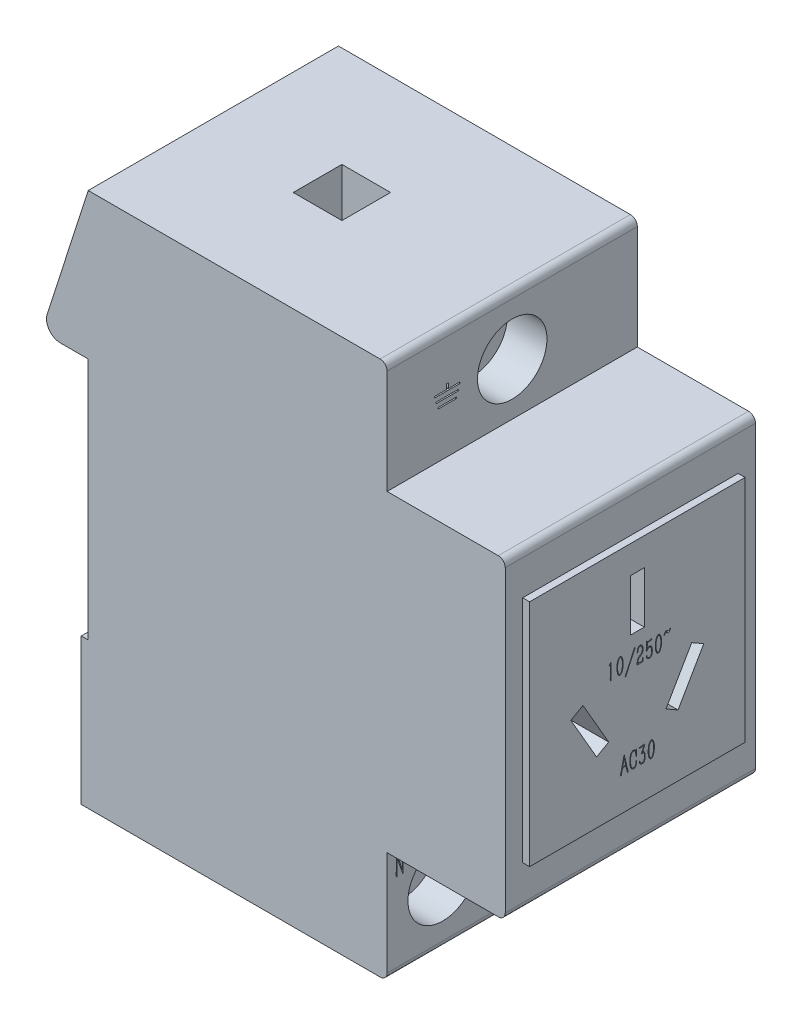
from build123d import *

# Parameters (mm, degrees)
EXTRUDE_1_DEPTH           = 18
SKETCH_2_W                = 32
SKETCH_2_H                = 32
CUT_EXTRUDE_1_DEPTH       = 34
HOLE_WIZARD_1_D           = 5.5
HOLE_WIZARD_1_DEPTH       = 7.5
HOLE_WIZARD_1_CBORE_D     = 10
HOLE_WIZARD_1_CBORE_DEPTH = 5.7
HOLE_WIZARD_1_TIP         = 1.652366702
HOLE_WIZARD_3_D           = 5.5
HOLE_WIZARD_3_DEPTH       = 7.5
HOLE_WIZARD_3_CBORE_D     = 10
HOLE_WIZARD_3_CBORE_DEPTH = 5.7
HOLE_WIZARD_3_TIP         = 1.652366702
SKETCH_13_W               = 31
SKETCH_13_H               = 33
EXTRUDE_2_DEPTH           = 1
SKETCH_3P_W               = 2
SKETCH_3P_H               = 7.4
CUT_EXTRUDE_2_DEPTH       = 12
SKETCH_15_W               = 7
SKETCH_15_H               = 7
CUT_EXTRUDE_3_DEPTH       = 12
SKETCH_16_W               = 7
SKETCH_16_H               = 7
CUT_EXTRUDE_4_DEPTH       = 12
CUT_EXTRUDE_5_REACH       = 105
SKETCH_17_W               = 5
SKETCH_17_H               = 10.932340583
SKETCH_17_H_2             = 13.985516782
CUT_EXTRUDE_6_DEPTH       = 0.25
CUT_EXTRUDE_7_DEPTH       = 0.25
CUT_EXTRUDE_8_DEPTH       = 0.25
SKETCH_4225_W             = 3.212328767
SKETCH_4225_H             = 0.191780821
SKETCH_4225_W_2           = 2.636986302
SKETCH_4225_H_2           = 0.191780822
CUT_EXTRUDE_9_DEPTH       = 0.25


with BuildPart() as part:
    # Sketch 223 → 凸台-拉伸1 (new, symmetric)
    with BuildSketch(Plane.XY):
        with BuildLine():
            Line((0, 1), (0, 20))
            ThreePointArc((0, 20), (0.292893219, 20.707106781), (1, 21))
            Line((1, 21), (5, 21))
            Line((5, 21), (5, 56))
            Line((5, 56), (1, 56))
            ThreePointArc((1, 56), (-0.615989127, 56.82162012), (-0.904249074, 58.611420858))
            Line((-0.904249074, 58.611420858), (5, 77))
            Line((5, 77), (47, 77))
            ThreePointArc((47, 77), (47.707106781, 76.707106781), (48, 76))
            Line((48, 76), (48, 61))
            Line((48, 61), (64, 61))
            ThreePointArc((64, 61), (64.707106781, 60.707106781), (65, 60))
            Line((65, 60), (65, 17))
            ThreePointArc((65, 17), (64.707106781, 16.292893219), (64, 16))
            Line((64, 16), (48, 16))
            Line((48, 16), (48, 1))
            ThreePointArc((48, 1), (47.707106781, 0.292893219), (47, 0))
            Line((47, 0), (1, 0))
            ThreePointArc((1, 0), (0.292893219, 0.292893219), (0, 1))
        make_face()
    extrude(amount=EXTRUDE_1_DEPTH, both=True)

    # 草图2 → 切除-拉伸1 (cut)
    with BuildSketch(Plane.ZY.offset(-5)):
        with Locations((0, 38.500117389)):
            Rectangle(SKETCH_2_W, SKETCH_2_H)
    extrude(amount=-CUT_EXTRUDE_1_DEPTH, mode=Mode.SUBTRACT)

    # 打孔尺寸(%根据)开槽圆柱头螺钉的类型1
    with Locations(Plane(origin=(48, 0, 0), x_dir=(0, 0, -1), z_dir=(1, 0, 0))):
        with Locations((0, 68.5)):
            CounterBoreHole(HOLE_WIZARD_1_D / 2, HOLE_WIZARD_1_CBORE_D / 2, HOLE_WIZARD_1_CBORE_DEPTH, depth=HOLE_WIZARD_1_DEPTH)
            with Locations((0, 0, -(HOLE_WIZARD_1_DEPTH + HOLE_WIZARD_1_TIP / 2))):  # 118° drill point
                Cone(0, HOLE_WIZARD_1_D / 2, HOLE_WIZARD_1_TIP, mode=Mode.SUBTRACT)

    # 打孔尺寸(%根据)开槽圆柱头螺钉的类型3
    with Locations(Plane(origin=(48, 0, 0), x_dir=(0, 0, -1), z_dir=(1, 0, 0))):
        with Locations((10, 8.405431572), (-10.003496092, 8.477343962)):
            CounterBoreHole(HOLE_WIZARD_3_D / 2, HOLE_WIZARD_3_CBORE_D / 2, HOLE_WIZARD_3_CBORE_DEPTH, depth=HOLE_WIZARD_3_DEPTH)
            with Locations((0, 0, -(HOLE_WIZARD_3_DEPTH + HOLE_WIZARD_3_TIP / 2))):  # 118° drill point
                Cone(0, HOLE_WIZARD_3_D / 2, HOLE_WIZARD_3_TIP, mode=Mode.SUBTRACT)

    # 草图13 → 凸台-拉伸2 (add)
    with BuildSketch(Plane(origin=(65, 0, 0), x_dir=(0, 0, -1), z_dir=(1, 0, 0))):
        with Locations((0, 38.5)):
            Rectangle(SKETCH_13_W, SKETCH_13_H)
    extrude(amount=EXTRUDE_2_DEPTH)

    # 3P插孔 → 切除-拉伸2 (cut)
    with BuildSketch(Plane(origin=(66, 0, 0), x_dir=(0, 0, -1), z_dir=(1, 0, 0))):
        Polygon((4.125575286, 31.845706006), (5.857626094, 30.845706006), (9.557626094, 37.254293994), (7.825575286, 38.254293994), align=None)
        Polygon((-4.125575286, 31.845706006), (-5.857626094, 30.845706006), (-9.557626094, 37.254293994), (-7.825575286, 38.254293994), align=None)
        with Locations((0, 47.3)):
            Rectangle(SKETCH_3P_W, SKETCH_3P_H)
    extrude(amount=-CUT_EXTRUDE_2_DEPTH, mode=Mode.SUBTRACT)

    # 草图15 → 切除-拉伸3 (cut)
    with BuildSketch(Plane(origin=(0, 77, 0), x_dir=(1, 0, 0), z_dir=(0, 1, 0))):
        with Locations((23.5, 0)):
            Rectangle(SKETCH_15_W, SKETCH_15_H)
    extrude(amount=-CUT_EXTRUDE_3_DEPTH, mode=Mode.SUBTRACT)

    # 草图16 → 切除-拉伸4 (cut)
    with BuildSketch(Plane.XZ):
        with Locations((24.5, 9)):
            Rectangle(SKETCH_16_W, SKETCH_16_H)
        with Locations((24.5, -9)):
            Rectangle(SKETCH_16_W, SKETCH_16_H)
    extrude(amount=-CUT_EXTRUDE_4_DEPTH, mode=Mode.SUBTRACT)

    # 切除-拉伸5: up to this face of the body (flat: up to its plane)
    cut_extrude_5_end = Plane(part.part.faces().sort_by_distance((3, 21, 0))[0])
    # 草图17 → 切除-拉伸5 (cut, up to the picked face)
    with BuildSketch(Plane.XZ, mode=Mode.PRIVATE) as cut_extrude_5_sk1:
        with Locations((1.5, -14.466170292)):
            Rectangle(SKETCH_17_W, SKETCH_17_H)
    cut_extrude_5_tool1 = split(extrude(cut_extrude_5_sk1.sketch, amount=-CUT_EXTRUDE_5_REACH, mode=Mode.PRIVATE), bisect_by=cut_extrude_5_end, keep=Keep.BOTH, mode=Mode.PRIVATE)
    # 草图17 → 切除-拉伸5 (cut, up to the picked face)
    with BuildSketch(Plane.XZ, mode=Mode.PRIVATE) as cut_extrude_5_sk2:
        with Locations((1.5, 14.466170292)):
            Rectangle(SKETCH_17_W, SKETCH_17_H)
    cut_extrude_5_tool2 = split(extrude(cut_extrude_5_sk2.sketch, amount=-CUT_EXTRUDE_5_REACH, mode=Mode.PRIVATE), bisect_by=cut_extrude_5_end, keep=Keep.BOTH, mode=Mode.PRIVATE)
    # 草图17 → 切除-拉伸5 (cut, up to the picked face)
    with BuildSketch(Plane.XZ, mode=Mode.PRIVATE) as cut_extrude_5_sk3:
        with Locations((1.5, 0)):
            Rectangle(SKETCH_17_W, SKETCH_17_H_2)
    cut_extrude_5_tool3 = split(extrude(cut_extrude_5_sk3.sketch, amount=-CUT_EXTRUDE_5_REACH, mode=Mode.PRIVATE), bisect_by=cut_extrude_5_end, keep=Keep.BOTH, mode=Mode.PRIVATE)
    add(cut_extrude_5_tool1.solids().sort_by(Axis((1.5, 0, -14.46617), (0, 1, 0)))[0], mode=Mode.SUBTRACT)
    add(cut_extrude_5_tool2.solids().sort_by(Axis((1.5, 0, 14.46617), (0, 1, 0)))[0], mode=Mode.SUBTRACT)
    add(cut_extrude_5_tool3.solids().sort_by(Axis((1.5, 0, 0), (0, 1, 0)))[0], mode=Mode.SUBTRACT)

    # 文字10250 → 切除-拉伸6 (cut)
    # profile 1 of 7: a face of its own
    with BuildSketch(Plane(origin=(66, 0, 0), x_dir=(0, 0, -1), z_dir=(1, 0, 0))):
        with BuildLine():
            Line((-3.794743686, 41.667762175), (-3.755323272, 41.667762175))
            Line((-3.755323272, 41.667762175), (-3.75905223, 39.758002959))
            add(Edge.make_bspline(
                [(-3.75905223, 39.758002959), (-3.759477028, 39.740779896), (-3.760291532, 39.707756588), (-3.760357635, 39.6605088), (-3.761911501, 39.61773031), (-3.762035266, 39.579359871), (-3.763190696, 39.545447611), (-3.764526839, 39.515986433), (-3.764653798, 39.490921112), (-3.767017196, 39.451690651), (-3.769833497, 39.397751691), (-3.77681778, 39.34219548), (-3.782377794, 39.302609355), (-3.788030006, 39.284589059), (-3.79519078, 39.27033081), (-3.802337218, 39.271993585), (-3.805397851, 39.272705708)],
                knots=[0, 0, 0, 0, 1.45038606, 2.780953852, 3.977268029, 5.053718292, 6.010937745, 6.833690271, 7.536464333, 8.120251454, 10.142880859, 12.069479857, 12.873132744, 13.440417135, 13.76034519, 14, 14, 14, 14], degree=3))
            add(Edge.make_bspline(
                [(-3.805397851, 39.272705708), (-3.806105372, 39.273241253), (-3.809133734, 39.275533515), (-3.816355539, 39.280385392), (-3.824936533, 39.293391134), (-3.828692756, 39.305059033), (-3.830967849, 39.312126121)],
                knots=[0, 0, 0, 0, 0.221265066, 0.947068446, 2.150880552, 4, 4, 4, 4], degree=3))
            Line((-3.830967849, 39.312126121), (-3.848547223, 39.359004451))
            Line((-3.848547223, 39.359004451), (-3.888500344, 39.488452565))
            add(Edge.make_bspline(
                [(-3.888500344, 39.488452565), (-3.893309839, 39.500632299), (-3.901687729, 39.521848766), (-3.910139171, 39.549761976), (-3.916550721, 39.56758574), (-3.918254859, 39.582032675), (-3.910046018, 39.595583939), (-3.904000488, 39.616448754), (-3.894698033, 39.643081316), (-3.885913329, 39.674514957), (-3.878154363, 39.708478509), (-3.871164888, 39.74517506), (-3.867203752, 39.786519869), (-3.865260661, 39.825995483), (-3.863769454, 39.864002222), (-3.863498524, 39.900592124), (-3.862751265, 39.943915688), (-3.862868001, 39.975169891), (-3.862930347, 39.991861898)],
                knots=[0, 0, 0, 0, 1.220359697, 2.125803599, 2.712350858, 2.994193817, 3.439826662, 4.12562012, 5.031064022, 6.063176816, 7.167225426, 8.277459231, 9.542238136, 11.034069985, 11.961482632, 13.08703073, 14.444263491, 16, 16, 16, 16], degree=3))
            Line((-3.862930347, 39.991861898), (-3.859734097, 41.401408031))
            Line((-3.859734097, 41.401408031), (-4.046714706, 41.239464711))
            Line((-4.046714706, 41.239464711), (-4.06109783, 41.300726164))
            add(Edge.make_bspline(
                [(-4.06109783, 41.300726164), (-4.045898945, 41.316431249), (-4.017408009, 41.345871079), (-3.979331488, 41.388259143), (-3.948014882, 41.425045268), (-3.915396548, 41.468049972), (-3.878876601, 41.521569058), (-3.851907773, 41.565539043), (-3.837893057, 41.58838864)],
                knots=[0, 0, 0, 0, 1.077185482, 2.019228619, 2.808185376, 3.45765616, 4.678836699, 6, 6, 6, 6], degree=3))
            Line((-3.837893057, 41.58838864), (-3.794743686, 41.667762175))
        make_face()
    # profile 2 of 7: a face of its own
    with BuildSketch(Plane(origin=(66, 0, 0), x_dir=(0, 0, -1), z_dir=(1, 0, 0))):
        with BuildLine():
            add(Edge.make_bspline(
                [(-2.938148757, 40.545878519), (-2.936412763, 40.580340653), (-2.932856037, 40.65094711), (-2.92318712, 40.759170127), (-2.908925151, 40.872071836), (-2.892386705, 40.988019676), (-2.869501952, 41.102559926), (-2.840213753, 41.211486752), (-2.802825027, 41.312199013), (-2.765516928, 41.389533131), (-2.733978357, 41.446233548), (-2.711031035, 41.483952029), (-2.689199854, 41.517967674), (-2.667691131, 41.547520975), (-2.646580249, 41.572686298), (-2.627110659, 41.594506767), (-2.607461522, 41.611495052), (-2.582818659, 41.628340493), (-2.552822984, 41.64336484), (-2.518063609, 41.65650841), (-2.484617489, 41.664111547), (-2.46282899, 41.664058706), (-2.452318797, 41.664033217)],
                knots=[0, 0, 0, 0, 1.583211401, 3.243703523, 4.983978234, 6.804605119, 8.6166428, 10.340282122, 11.974804003, 13.53820457, 14.274983449, 14.951299633, 15.563740824, 16.129235462, 16.626851747, 17.070813204, 17.469389546, 17.815167281, 18.438300608, 19.002855301, 19.519003895, 20, 20, 20, 20], degree=3))
            add(Edge.make_bspline(
                [(-2.452318797, 41.664033217), (-2.442268664, 41.662275836), (-2.421041219, 41.658563973), (-2.389658393, 41.644762545), (-2.356350043, 41.626408194), (-2.320911702, 41.602619325), (-2.285529891, 41.570633904), (-2.252739396, 41.528270138), (-2.22229751, 41.476532034), (-2.184467079, 41.394648504), (-2.142779226, 41.283660951), (-2.11004613, 41.167125616), (-2.088783731, 41.069824033), (-2.074917245, 40.992193094), (-2.063891169, 40.909873322), (-2.052050912, 40.79414773), (-2.041491579, 40.645856606), (-2.039789738, 40.526366183), (-2.038937165, 40.466504984)],
                knots=[0, 0, 0, 0, 0.36369769, 0.768186139, 1.217229854, 1.724510149, 2.290946358, 2.914777825, 3.632489608, 4.433551378, 6.137860108, 7.866765886, 8.757390638, 9.699141408, 10.686159515, 11.726895222, 13.859299765, 16, 16, 16, 16], degree=3))
            add(Edge.make_bspline(
                [(-2.038937165, 40.466504984), (-2.042198267, 40.418538861), (-2.048900511, 40.319958472), (-2.064844766, 40.168978641), (-2.091141209, 40.011912922), (-2.12423195, 39.879607707), (-2.156238929, 39.774264451), (-2.183381955, 39.698249744), (-2.213752005, 39.626464734), (-2.246166289, 39.559605104), (-2.279887256, 39.500087802), (-2.314793551, 39.450076032), (-2.35167893, 39.411556908), (-2.389573817, 39.383888599), (-2.426573308, 39.36513819), (-2.461926141, 39.35314944), (-2.495592771, 39.346494794), (-2.517466373, 39.347748594), (-2.527963374, 39.348350285)],
                knots=[0, 0, 0, 0, 1.760488992, 3.618172134, 5.557361062, 7.587083219, 8.607294374, 9.588398617, 10.541277716, 11.460251193, 12.307925722, 13.044175775, 13.687957546, 14.251129358, 14.754223989, 15.200440537, 15.616296545, 16, 16, 16, 16], degree=3))
            add(Edge.make_bspline(
                [(-2.527963374, 39.348350285), (-2.537993552, 39.349760182), (-2.559126361, 39.352730725), (-2.590980919, 39.36523112), (-2.624153224, 39.384490863), (-2.659566942, 39.409879161), (-2.695226599, 39.444758879), (-2.729564747, 39.489873389), (-2.762494571, 39.545467831), (-2.793788811, 39.610481639), (-2.823181733, 39.682895954), (-2.848918943, 39.761032119), (-2.872763957, 39.843140226), (-2.891870234, 39.928988567), (-2.907592679, 40.015752148), (-2.919928801, 40.101036812), (-2.928584564, 40.183844837), (-2.933255854, 40.263845946), (-2.934889282, 40.34042859), (-2.936615583, 40.412873968), (-2.937695538, 40.480885259), (-2.938001403, 40.524747472), (-2.938148757, 40.545878519)],
                knots=[0, 0, 0, 0, 0.451175502, 0.950591959, 1.515271951, 2.162531354, 2.891688268, 3.734081857, 4.687580886, 5.773002708, 6.954198864, 8.17563603, 9.445923076, 10.771603705, 12.101713585, 13.383756751, 14.619631726, 15.819374781, 16.961914306, 18.040825747, 19.056148764, 20, 20, 20, 20], degree=3))
        make_face()
        with BuildLine():
            add(Edge.make_bspline(
                [(-2.844392098, 40.538420603), (-2.844771202, 40.521197162), (-2.845576235, 40.484622844), (-2.846341848, 40.426370643), (-2.844913546, 40.361551653), (-2.842473048, 40.265901259), (-2.833513037, 40.140898198), (-2.810612881, 39.990826258), (-2.777907078, 39.845493506), (-2.741868237, 39.731608304), (-2.708316354, 39.650423863), (-2.682570074, 39.600037873), (-2.655484056, 39.559332865), (-2.627106116, 39.528327529), (-2.598401122, 39.506354542), (-2.571575246, 39.490653114), (-2.546154391, 39.479871351), (-2.529117735, 39.478465241), (-2.521038167, 39.477798399)],
                knots=[0, 0, 0, 0, 0.705717407, 1.498604912, 2.386138873, 3.361274458, 5.418191474, 7.514713171, 9.57394393, 11.515405308, 12.398906158, 13.169972934, 13.829695216, 14.395845116, 14.883250105, 15.303691084, 15.669778158, 16, 16, 16, 16], degree=3))
            add(Edge.make_bspline(
                [(-2.521038167, 39.477798399), (-2.5135583, 39.477894604), (-2.497491648, 39.478101252), (-2.472354617, 39.484146275), (-2.445928207, 39.496871249), (-2.416615385, 39.513592978), (-2.386501636, 39.539328168), (-2.356778829, 39.574498238), (-2.327645996, 39.619572742), (-2.298591447, 39.672871911), (-2.271107951, 39.732170348), (-2.246488522, 39.794994939), (-2.225063021, 39.859847457), (-2.201891159, 39.950580517), (-2.178069368, 40.06825779), (-2.156671955, 40.211960964), (-2.142481909, 40.353672828), (-2.136572501, 40.469282606), (-2.13492873, 40.560794376), (-2.1362948, 40.633615664), (-2.1388722, 40.711760588), (-2.141823348, 40.765714063), (-2.14334799, 40.793587873)],
                knots=[0, 0, 0, 0, 0.308126263, 0.661851094, 1.055455993, 1.515432549, 2.051181639, 2.679899785, 3.409545513, 4.262246801, 5.183512362, 6.104777924, 7.045624675, 8.000099589, 9.967578284, 11.997814557, 13.993544283, 15.842664909, 16.77344086, 17.770161498, 18.848005724, 20, 20, 20, 20], degree=3))
            add(Edge.make_bspline(
                [(-2.14334799, 40.793587873), (-2.145917148, 40.81969996), (-2.150903847, 40.870383146), (-2.159670837, 40.943632243), (-2.170549726, 41.011614269), (-2.185878878, 41.095366702), (-2.210624148, 41.195861215), (-2.244709009, 41.291535026), (-2.274106804, 41.363769662), (-2.299375048, 41.409537122), (-2.325074846, 41.448377692), (-2.353633786, 41.478017941), (-2.38143266, 41.501115499), (-2.40759659, 41.518378684), (-2.432033792, 41.530567319), (-2.448489649, 41.533320554), (-2.456047755, 41.534585103)],
                knots=[0, 0, 0, 0, 1.302834758, 2.528783491, 3.662347304, 4.720685654, 6.75648594, 8.792057095, 9.759925264, 10.624039914, 11.384659521, 12.06448684, 12.659424566, 13.175428451, 13.621277708, 14, 14, 14, 14], degree=3))
            add(Edge.make_bspline(
                [(-2.456047755, 41.534585103), (-2.464263806, 41.53398723), (-2.48152865, 41.532730888), (-2.507885001, 41.524652197), (-2.535859014, 41.512019792), (-2.566592329, 41.49449717), (-2.59860765, 41.466373579), (-2.630934573, 41.425206454), (-2.664384526, 41.370600992), (-2.699297321, 41.303381724), (-2.732655579, 41.22418411), (-2.760997746, 41.133470364), (-2.785489113, 41.032775118), (-2.803936612, 40.92493737), (-2.818838496, 40.817009291), (-2.830457794, 40.715562697), (-2.839359283, 40.623759377), (-2.842778679, 40.565778494), (-2.844392098, 40.538420603)],
                knots=[0, 0, 0, 0, 0.347392606, 0.729995465, 1.156884588, 1.644891073, 2.219813456, 2.945627096, 3.849684979, 4.924243867, 6.145708801, 7.477723151, 8.938118981, 10.524254447, 12.100980159, 13.544449593, 14.841364989, 16, 16, 16, 16], degree=3))
        make_face(mode=Mode.SUBTRACT)
    # profile 3 of 7: a face of its own
    with BuildSketch(Plane(origin=(66, 0, 0), x_dir=(0, 0, -1), z_dir=(1, 0, 0))):
        with BuildLine():
            Line((-1.717714067, 38.898744489), (-0.441345007, 41.649650093))
            add(Edge.make_bspline(
                [(-0.441345007, 41.649650093), (-0.437969039, 41.660008731), (-0.431883321, 41.678681822), (-0.421427478, 41.702946868), (-0.410906348, 41.720519143), (-0.39991004, 41.732619314), (-0.387316359, 41.738047227), (-0.374150017, 41.73993249), (-0.360180014, 41.736808989), (-0.346465885, 41.730420789), (-0.334599896, 41.722999988), (-0.325826272, 41.713864214), (-0.324758206, 41.702325515), (-0.328214899, 41.696054312), (-0.330008974, 41.692799465)],
                knots=[0, 0, 0, 0, 1.994194769, 3.594853091, 4.821438403, 5.740802964, 6.526308389, 7.280243386, 8.140844243, 9.101239236, 10.038810803, 10.708907119, 11.329903684, 12, 12, 12, 12], degree=3))
            Line((-0.330008974, 41.692799465), (-0.36570043, 41.584659682))
            Line((-0.36570043, 41.584659682), (-1.63887324, 38.84866991))
            add(Edge.make_bspline(
                [(-1.63887324, 38.84866991), (-1.643014201, 38.839202861), (-1.650625946, 38.821800918), (-1.662967246, 38.79828456), (-1.675395336, 38.779636355), (-1.688099056, 38.765943778), (-1.700786791, 38.757210626), (-1.713835431, 38.753383629), (-1.727102421, 38.755845101), (-1.738280603, 38.763592323), (-1.748048783, 38.773984403), (-1.751546703, 38.788296927), (-1.750349495, 38.804166794), (-1.745788315, 38.814325933), (-1.743284065, 38.819903662)],
                knots=[0, 0, 0, 0, 1.74914986, 3.215216151, 4.49108061, 5.532964173, 6.358495116, 7.073109752, 7.774962386, 8.558937252, 9.348083133, 10.128591623, 10.972530108, 12, 12, 12, 12], degree=3))
            Line((-1.743284065, 38.819903662), (-1.717714067, 38.898744489))
        make_face()
    # profile 4 of 7: a face of its own
    with BuildSketch(Plane(origin=(66, 0, 0), x_dir=(0, 0, -1), z_dir=(1, 0, 0))):
        with BuildLine():
            Line((0.048213911, 40.739784336), (-0.006122335, 40.739784336))
            add(Edge.make_bspline(
                [(-0.006122335, 40.739784336), (-0.007241909, 40.757005232), (-0.009376289, 40.789835508), (-0.011578677, 40.836720704), (-0.012508757, 40.878817878), (-0.013440483, 40.930139265), (-0.012003526, 40.994862023), (-0.008145178, 41.046993701), (-0.006122335, 41.074325141)],
                knots=[0, 0, 0, 0, 0.927540379, 1.768282303, 2.522502339, 3.190652681, 4.527123766, 6, 6, 6, 6], degree=3))
            add(Edge.make_bspline(
                [(-0.006122335, 41.074325141), (-0.004722401, 41.094586768), (-0.002015089, 41.133770432), (0.005129914, 41.190243651), (0.013398847, 41.242575348), (0.024149244, 41.291797172), (0.038674801, 41.339965644), (0.059353503, 41.388414826), (0.08514374, 41.438804158), (0.115614219, 41.489369833), (0.149047532, 41.537082606), (0.186575038, 41.575909212), (0.225850624, 41.605502924), (0.267638915, 41.623115693), (0.307761728, 41.634068322), (0.344350446, 41.642683733), (0.377230146, 41.64870474), (0.398003525, 41.649347312), (0.407792006, 41.649650093)],
                knots=[0, 0, 0, 0, 1.238521709, 2.395159043, 3.470603583, 4.46912877, 5.466066804, 6.534123646, 7.677244524, 8.916145015, 10.13365226, 11.221244199, 12.198275335, 13.109907183, 13.966820176, 14.733954848, 15.403435577, 16, 16, 16, 16], degree=3))
            add(Edge.make_bspline(
                [(0.407792006, 41.649650093), (0.420266431, 41.64873032), (0.444915509, 41.646912878), (0.481173621, 41.638492167), (0.516191515, 41.62635076), (0.560980583, 41.604722174), (0.613354188, 41.570811533), (0.657910173, 41.526281245), (0.688741649, 41.48551959), (0.710459401, 41.45082827), (0.729704756, 41.412090588), (0.753873401, 41.355803417), (0.779157165, 41.28110983), (0.797390523, 41.186771311), (0.809081303, 41.088804959), (0.814430207, 40.988653844), (0.815424778, 40.889489832), (0.809602112, 40.824816672), (0.806790514, 40.793587873)],
                knots=[0, 0, 0, 0, 0.570779476, 1.127842599, 1.694919432, 2.261066821, 3.397481896, 4.527710891, 5.118384485, 5.730727279, 6.394748858, 7.092559246, 8.529363642, 9.986910621, 11.474321506, 13.03467297, 14.568129345, 16, 16, 16, 16], degree=3))
            add(Edge.make_bspline(
                [(0.806790514, 40.793587873), (0.801090961, 40.761464839), (0.789606816, 40.69673949), (0.764871326, 40.618811062), (0.741802677, 40.559565374), (0.722516076, 40.519864728), (0.701908533, 40.484718594), (0.67211015, 40.443154808), (0.626604126, 40.395975265), (0.584435371, 40.364336117), (0.56227741, 40.347711035)],
                knots=[0, 0, 0, 0, 1.490916612, 3.004077927, 3.729534125, 4.397912905, 5.020560084, 5.590839424, 6.734084393, 8, 8, 8, 8], degree=3))
            Line((0.56227741, 40.347711035), (0.385950966, 40.236375003))
            add(Edge.make_bspline(
                [(0.385950966, 40.236375003), (0.363481677, 40.221120885), (0.320875618, 40.192196167), (0.263984766, 40.144949), (0.216234408, 40.095166083), (0.180142198, 40.040120905), (0.152110119, 39.98345962), (0.127218524, 39.926566151), (0.108426635, 39.863856453), (0.095061114, 39.807647986), (0.08594627, 39.76044133), (0.081380463, 39.727518401), (0.077671362, 39.698420713), (0.077200924, 39.680237271), (0.076980158, 39.671704216)],
                knots=[0, 0, 0, 0, 1.453572249, 2.75625039, 3.953730064, 5.132566341, 6.263730064, 7.337486329, 8.453238547, 9.76321854, 10.430854957, 11.026567013, 11.543191201, 12, 12, 12, 12], degree=3))
            Line((0.076980158, 39.671704216), (0.069522242, 39.520947771))
            Line((0.069522242, 39.520947771), (0.713033855, 39.542256102))
            add(Edge.make_bspline(
                [(0.713033855, 39.542256102), (0.721291197, 39.542717791), (0.735794369, 39.543528701), (0.749732808, 39.558723977), (0.752835343, 39.57727742), (0.758340599, 39.600097621), (0.76243338, 39.632808344), (0.765590674, 39.657684311), (0.767370101, 39.671704216)],
                knots=[0, 0, 0, 0, 0.925905201, 1.626257371, 2.181371879, 3.087088273, 4.358305093, 6, 6, 6, 6], degree=3))
            Line((0.767370101, 39.671704216), (0.781753225, 39.98493669))
            Line((0.781753225, 39.98493669), (0.831827804, 39.98493669))
            Line((0.831827804, 39.98493669), (0.849939886, 39.510293605))
            add(Edge.make_bspline(
                [(0.849939886, 39.510293605), (0.850545382, 39.501066026), (0.851604397, 39.484926981), (0.852119911, 39.463577357), (0.852134502, 39.44871127), (0.851909667, 39.436708412), (0.848043817, 39.426214088), (0.844451665, 39.414037217), (0.830439016, 39.407157859), (0.810296829, 39.404956767), (0.779685182, 39.401839427), (0.755659576, 39.402038807), (0.741800103, 39.402153822)],
                knots=[0, 0, 0, 0, 1.385018147, 2.4223982, 3.193529914, 3.619812046, 4.200562765, 4.878496499, 5.402948042, 6.404258339, 7.925751149, 10, 10, 10, 10], degree=3))
            Line((0.741800103, 39.402153822), (0.026372871, 39.38404174))
            add(Edge.make_bspline(
                [(0.026372871, 39.38404174), (0.017676129, 39.384016298), (0.000534207, 39.38396615), (-0.017032217, 39.401011846), (-0.02440624, 39.421879092), (-0.028096909, 39.44642316), (-0.030569007, 39.478985012), (-0.03175645, 39.534989397), (-0.029217734, 39.61467503), (-0.023499348, 39.680428191), (-0.020505458, 39.714853588)],
                knots=[0, 0, 0, 0, 0.556373901, 1.096654043, 1.476064089, 2.012759395, 2.73145082, 3.635924119, 5.715166189, 8, 8, 8, 8], degree=3))
            add(Edge.make_bspline(
                [(-0.020505458, 39.714853588), (-0.01784863, 39.734947646), (-0.012730656, 39.773655777), (-0.002324616, 39.829374155), (0.008769909, 39.881093283), (0.020810397, 39.92878187), (0.034102503, 39.972188683), (0.048610801, 40.011264028), (0.063650887, 40.046637231), (0.086241876, 40.08665358), (0.114953265, 40.130272748), (0.147610893, 40.177304711), (0.179053829, 40.217200446), (0.220151278, 40.261092185), (0.275789357, 40.309000455), (0.322528882, 40.344080079), (0.346530553, 40.362094159)],
                knots=[0, 0, 0, 0, 1.103491021, 2.125706759, 3.085324024, 3.98349739, 4.803138144, 5.555704107, 6.252741852, 6.89323317, 8.054555834, 9.09539633, 10.010480884, 10.817709087, 12.365830683, 14, 14, 14, 14], degree=3))
            Line((0.346530553, 40.362094159), (0.494090749, 40.455850818))
            add(Edge.make_bspline(
                [(0.494090749, 40.455850818), (0.505904521, 40.463705332), (0.528575005, 40.478778047), (0.559887759, 40.502775033), (0.586583056, 40.527673613), (0.609588193, 40.554542433), (0.630413588, 40.585633467), (0.647516667, 40.624387954), (0.665597722, 40.670037009), (0.68667923, 40.741058408), (0.708415787, 40.83480041), (0.71674837, 40.950622347), (0.712297029, 41.067946343), (0.69868844, 41.145817782), (0.691725524, 41.185661174)],
                knots=[0, 0, 0, 0, 0.635613896, 1.219735276, 1.765761318, 2.268061313, 2.802129131, 3.435697723, 4.161225462, 5.001884758, 6.75303811, 8.46119913, 10.189351173, 12, 12, 12, 12], degree=3))
            add(Edge.make_bspline(
                [(0.691725524, 41.185661174), (0.686478848, 41.205973317), (0.676246089, 41.245588741), (0.656878417, 41.302656304), (0.631808153, 41.354632069), (0.604974212, 41.403185415), (0.571356357, 41.445686368), (0.526576867, 41.476210507), (0.473675976, 41.496615189), (0.434980308, 41.500208336), (0.414717214, 41.502089897)],
                knots=[0, 0, 0, 0, 1.101106684, 2.147523679, 3.156537618, 4.125318695, 5.058520457, 5.968677808, 6.93629249, 8, 8, 8, 8], degree=3))
            add(Edge.make_bspline(
                [(0.414717214, 41.502089897), (0.404051216, 41.502199095), (0.382777138, 41.502416897), (0.351090336, 41.497611682), (0.320270556, 41.487536455), (0.279785973, 41.469275664), (0.233005223, 41.435260754), (0.183764965, 41.383938701), (0.143149581, 41.321273356), (0.111878847, 41.248655652), (0.088365583, 41.165924291), (0.069277415, 41.07320491), (0.056743574, 40.969321716), (0.053241833, 40.896611287), (0.051410161, 40.858578284)],
                knots=[0, 0, 0, 0, 0.469335518, 0.936122588, 1.403629858, 1.893624907, 2.887406355, 3.927357629, 5.011993806, 6.157121359, 7.396943717, 8.794309501, 10.323183677, 12, 12, 12, 12], degree=3))
            Line((0.051410161, 40.858578284), (0.048213911, 40.739784336))
        make_face()
    # profile 5 of 7: a face of its own
    with BuildSketch(Plane(origin=(66, 0, 0), x_dir=(0, 0, -1), z_dir=(1, 0, 0))):
        with BuildLine():
            add(Edge.make_bspline(
                [(1.440713378, 41.538314061), (1.449089473, 41.53919733), (1.463602156, 41.540727709), (1.477841669, 41.543898515), (1.48386275, 41.545239269)],
                knots=[0, 0, 0, 0, 1.154313806, 2, 2, 2, 2], degree=3))
            Line((1.48386275, 41.545239269), (1.559507327, 41.548968227))
            Line((1.559507327, 41.548968227), (1.699609607, 41.570276558))
            Line((1.699609607, 41.570276558), (1.818403555, 41.584659682))
            add(Edge.make_bspline(
                [(1.818403555, 41.584659682), (1.829501155, 41.586453822), (1.852824467, 41.590224483), (1.874977792, 41.598456612), (1.886590216, 41.602771764)],
                knots=[0, 0, 0, 0, 0.951631555, 2, 2, 2, 2], degree=3))
            Line((1.886590216, 41.602771764), (1.940393753, 41.624612804))
            add(Edge.make_bspline(
                [(1.940393753, 41.624612804), (1.945929903, 41.626667276), (1.955642933, 41.630271795), (1.968035267, 41.635940014), (1.976958777, 41.63956409), (1.981766924, 41.641483222), (1.983543125, 41.642192177)],
                knots=[0, 0, 0, 0, 1.520021181, 2.666837392, 3.507509911, 4, 4, 4, 4], degree=3))
            Line((1.983543125, 41.642192177), (2.01603833, 41.664033217))
            Line((2.01603833, 41.664033217), (2.120449155, 41.559622392))
            add(Edge.make_bspline(
                [(2.120449155, 41.559622392), (2.124361981, 41.554395332), (2.131212139, 41.545244353), (2.133748597, 41.529572005), (2.130403799, 41.518183759), (2.126588427, 41.508161042), (2.115809435, 41.502122946), (2.107382862, 41.502102275), (2.102337073, 41.502089897)],
                knots=[0, 0, 0, 0, 1.452844315, 2.54348448, 3.406058373, 4.120848162, 4.874773518, 6, 6, 6, 6], degree=3))
            Line((2.102337073, 41.502089897), (1.433255462, 41.408865947))
            Line((1.433255462, 41.408865947), (1.422601296, 40.678522883))
            add(Edge.make_bspline(
                [(1.422601296, 40.678522883), (1.436216898, 40.695078216), (1.461332678, 40.725616721), (1.498660539, 40.769358551), (1.54204031, 40.806517705), (1.586572509, 40.83051089), (1.628327445, 40.847530408), (1.665323006, 40.856194171), (1.706191396, 40.861643609), (1.734748367, 40.862079345), (1.749684186, 40.862307242)],
                knots=[0, 0, 0, 0, 1.30943776, 2.415431215, 3.508265892, 4.775479805, 5.486396256, 6.257089544, 7.088425914, 8, 8, 8, 8], degree=3))
            add(Edge.make_bspline(
                [(1.749684186, 40.862307242), (1.764454883, 40.86135012), (1.792374382, 40.859540973), (1.831302228, 40.852660673), (1.865103735, 40.842972449), (1.90367782, 40.823117376), (1.948747799, 40.788738988), (1.991234815, 40.746716611), (2.024304421, 40.705997696), (2.048685641, 40.671009791), (2.068956169, 40.630986312), (2.088294966, 40.587901919), (2.105523232, 40.54063574), (2.119747372, 40.488774498), (2.131376885, 40.4323517), (2.143325493, 40.349266936), (2.153888473, 40.236807938), (2.155368975, 40.144423382), (2.15614061, 40.096272723)],
                knots=[0, 0, 0, 0, 0.737858689, 1.39469691, 1.969129469, 2.484137971, 3.548991738, 4.782985237, 5.456749125, 6.164369648, 6.905359031, 7.690566505, 8.520047268, 9.411980184, 10.370982938, 11.392008999, 13.598323608, 16, 16, 16, 16], degree=3))
            add(Edge.make_bspline(
                [(2.15614061, 40.096272723), (2.15527909, 40.074786273), (2.153612562, 40.033222832), (2.150767848, 39.97297065), (2.145843127, 39.917032084), (2.138262256, 39.849765293), (2.126516634, 39.772709262), (2.105890692, 39.687247868), (2.077482832, 39.60849939), (2.0395358, 39.537587321), (1.996599477, 39.475648717), (1.950646095, 39.426149216), (1.903215425, 39.390151054), (1.852682589, 39.367474797), (1.797513843, 39.357344899), (1.759306633, 39.355992966), (1.73903002, 39.355275493)],
                knots=[0, 0, 0, 0, 0.953497838, 1.844448518, 2.674189816, 3.442807412, 4.845957472, 6.127295929, 7.335424679, 8.547012004, 9.682888764, 10.668703604, 11.530079681, 12.305522429, 13.100738679, 14, 14, 14, 14], degree=3))
            add(Edge.make_bspline(
                [(1.73903002, 39.355275493), (1.714700477, 39.354854957), (1.669576254, 39.354074985), (1.60471956, 39.361829899), (1.545886129, 39.38312095), (1.489933169, 39.415635104), (1.437649189, 39.461439084), (1.392620721, 39.517542201), (1.356690174, 39.578188982), (1.330663997, 39.641474714), (1.314737457, 39.709799671), (1.301154574, 39.784192347), (1.292050102, 39.862914197), (1.292792805, 39.916019378), (1.293153182, 39.941787319)],
                knots=[0, 0, 0, 0, 1.038316962, 1.925775792, 2.769505923, 3.689817589, 4.672983852, 5.718137725, 6.747565775, 7.672204827, 8.626195073, 9.735182009, 10.901054531, 12, 12, 12, 12], degree=3))
            Line((1.293153182, 39.941787319), (1.29688214, 40.042469186))
            Line((1.29688214, 40.042469186), (1.336302554, 40.042469186))
            add(Edge.make_bspline(
                [(1.336302554, 40.042469186), (1.337943613, 40.022392608), (1.341188782, 39.982691502), (1.348443, 39.923195583), (1.360238062, 39.862814045), (1.374610777, 39.801723288), (1.393515114, 39.744091429), (1.413648842, 39.690904837), (1.442441155, 39.642499935), (1.477436178, 39.594085719), (1.522487239, 39.549397735), (1.567375005, 39.518435227), (1.608436543, 39.500766991), (1.643523237, 39.491077139), (1.682777335, 39.486111244), (1.710251529, 39.485200697), (1.724646896, 39.484723607)],
                knots=[0, 0, 0, 0, 1.11825376, 2.211328589, 3.324923754, 4.532299777, 5.691974021, 6.691431964, 7.680579644, 8.808308283, 10.000254076, 11.186807161, 11.80939407, 12.474247533, 13.200567339, 14, 14, 14, 14], degree=3))
            add(Edge.make_bspline(
                [(1.724646896, 39.484723607), (1.741561619, 39.484792989), (1.775691481, 39.484932985), (1.818577919, 39.495111436), (1.852343148, 39.511160571), (1.878513097, 39.529977053), (1.905849882, 39.553888562), (1.932247904, 39.584205797), (1.957974075, 39.61791814), (1.980651695, 39.654877682), (1.998782755, 39.69467431), (2.017897931, 39.751979214), (2.03565744, 39.829604609), (2.051939928, 39.929539347), (2.060419334, 40.038774712), (2.059607995, 40.114551197), (2.059187702, 40.153805218)],
                knots=[0, 0, 0, 0, 0.849390509, 1.713866746, 2.18933602, 2.722107664, 3.329685584, 4.012931591, 4.740083059, 5.461671267, 6.189151886, 6.934940173, 8.497098365, 10.188936476, 12.025778447, 14, 14, 14, 14], degree=3))
            add(Edge.make_bspline(
                [(2.059187702, 40.153805218), (2.057992776, 40.176729698), (2.055710483, 40.220515145), (2.048900853, 40.28298223), (2.041922865, 40.339223409), (2.029868728, 40.404983482), (2.010316511, 40.480192156), (1.982323187, 40.549964935), (1.955233641, 40.600339951), (1.933032895, 40.633759646), (1.907647779, 40.662307276), (1.879978979, 40.686456676), (1.849944892, 40.705708955), (1.818312892, 40.720390616), (1.784620059, 40.729699228), (1.761459043, 40.731794109), (1.749684186, 40.732859128)],
                knots=[0, 0, 0, 0, 1.343436322, 2.565945237, 3.677305729, 4.659990038, 6.477828082, 8.216935171, 9.044830502, 9.823221578, 10.559528994, 11.274319052, 11.966299338, 12.640726254, 13.308957145, 14, 14, 14, 14], degree=3))
            add(Edge.make_bspline(
                [(1.749684186, 40.732859128), (1.736873395, 40.732467029), (1.711970403, 40.731704823), (1.675700706, 40.725265781), (1.642101085, 40.713996945), (1.601874656, 40.694226305), (1.557799033, 40.665058609), (1.514962288, 40.625104489), (1.481413563, 40.584626343), (1.466048474, 40.555732392), (1.45882546, 40.542149561)],
                knots=[0, 0, 0, 0, 0.840347904, 1.633558669, 2.40744423, 3.157989381, 4.570423979, 5.856859538, 6.992525654, 8, 8, 8, 8], degree=3))
            Line((1.45882546, 40.542149561), (1.433255462, 40.491542273))
            Line((1.433255462, 40.491542273), (1.426330254, 40.445196652))
            add(Edge.make_bspline(
                [(1.426330254, 40.445196652), (1.425920884, 40.438830906), (1.425202206, 40.427655415), (1.422779281, 40.412767956), (1.421308103, 40.403591315), (1.42006234, 40.395282288), (1.411843324, 40.396291016), (1.403869823, 40.403763013), (1.389636295, 40.415243221), (1.378846962, 40.425061887), (1.372526717, 40.430813528)],
                knots=[0, 0, 0, 0, 1.417361355, 2.488272572, 3.242975776, 3.665551287, 3.979432497, 4.77388376, 6.110184861, 8, 8, 8, 8], degree=3))
            Line((1.372526717, 40.430813528), (1.29688214, 40.491542273))
            add(Edge.make_bspline(
                [(1.29688214, 40.491542273), (1.290398588, 40.497439211), (1.280334156, 40.506593041), (1.269276843, 40.523930902), (1.277504134, 40.542245952), (1.284815498, 40.553296143), (1.289424224, 40.560261642)],
                knots=[0, 0, 0, 0, 1.303116375, 2.022830373, 2.753688992, 4, 4, 4, 4], degree=3))
            Line((1.289424224, 40.560261642), (1.329377346, 40.61406518))
            Line((1.329377346, 40.61406518), (1.336302554, 40.998680564))
            Line((1.336302554, 40.998680564), (1.340031512, 41.275688874))
            add(Edge.make_bspline(
                [(1.340031512, 41.275688874), (1.340031928, 41.285987909), (1.340032824, 41.308184105), (1.340024984, 41.343697841), (1.340060389, 41.383651642), (1.339913203, 41.425910341), (1.340422739, 41.466588901), (1.338977043, 41.501199814), (1.338319625, 41.527875114), (1.3368965, 41.542757148), (1.336302554, 41.548968227)],
                knots=[0, 0, 0, 0, 0.904131945, 1.948560225, 3.117696361, 4.41154035, 5.658618894, 6.687930963, 7.452402571, 8, 8, 8, 8], degree=3))
            Line((1.336302554, 41.548968227), (1.32191943, 41.660304259))
            Line((1.32191943, 41.660304259), (1.358143593, 41.674687383))
            add(Edge.make_bspline(
                [(1.358143593, 41.674687383), (1.363419724, 41.661362802), (1.372290655, 41.638959745), (1.384747606, 41.609039684), (1.400451986, 41.586547257), (1.412473391, 41.573842827), (1.418872338, 41.567080309)],
                knots=[0, 0, 0, 0, 1.37928148, 2.31903137, 3.105226912, 4, 4, 4, 4], degree=3))
            Line((1.418872338, 41.567080309), (1.440713378, 41.538314061))
        make_face()
    # profile 6 of 7: a face of its own
    with BuildSketch(Plane(origin=(66, 0, 0), x_dir=(0, 0, -1), z_dir=(1, 0, 0))):
        with BuildLine():
            add(Edge.make_bspline(
                [(2.584970783, 40.545878519), (2.586706777, 40.580340653), (2.590263503, 40.65094711), (2.59993242, 40.759170127), (2.614194388, 40.872071836), (2.630732834, 40.988019676), (2.653617587, 41.102559926), (2.682905787, 41.211486752), (2.720294513, 41.312199013), (2.757602612, 41.389533131), (2.789141183, 41.446233548), (2.812088505, 41.483952029), (2.833919686, 41.517967674), (2.855428409, 41.547520975), (2.876539291, 41.572686298), (2.896008881, 41.594506767), (2.915658017, 41.611495052), (2.94030088, 41.628340493), (2.970296555, 41.64336484), (3.005055931, 41.65650841), (3.038502051, 41.664111547), (3.06029055, 41.664058706), (3.070800742, 41.664033217)],
                knots=[0, 0, 0, 0, 1.583211401, 3.243703523, 4.983978234, 6.804605119, 8.6166428, 10.340282122, 11.974804003, 13.53820457, 14.274983449, 14.951299633, 15.563740824, 16.129235462, 16.626851747, 17.070813204, 17.469389546, 17.815167281, 18.438300608, 19.002855301, 19.519003895, 20, 20, 20, 20], degree=3))
            add(Edge.make_bspline(
                [(3.070800742, 41.664033217), (3.080850875, 41.662275836), (3.102078321, 41.658563973), (3.133461147, 41.644762545), (3.166769497, 41.626408194), (3.202207838, 41.602619325), (3.237589649, 41.570633904), (3.270380144, 41.528270138), (3.30082203, 41.476532034), (3.33865246, 41.394648504), (3.380340314, 41.283660951), (3.41307341, 41.167125616), (3.434335809, 41.069824033), (3.448202295, 40.992193094), (3.459228371, 40.909873322), (3.471068628, 40.79414773), (3.48162796, 40.645856606), (3.483329802, 40.526366183), (3.484182375, 40.466504984)],
                knots=[0, 0, 0, 0, 0.36369769, 0.768186139, 1.217229854, 1.724510149, 2.290946358, 2.914777825, 3.632489608, 4.433551378, 6.137860108, 7.866765886, 8.757390638, 9.699141408, 10.686159515, 11.726895222, 13.859299765, 16, 16, 16, 16], degree=3))
            add(Edge.make_bspline(
                [(3.484182375, 40.466504984), (3.480921273, 40.418538861), (3.474219028, 40.319958472), (3.458274774, 40.168978641), (3.43197833, 40.011912922), (3.39888759, 39.879607707), (3.36688061, 39.774264451), (3.339737584, 39.698249744), (3.309367534, 39.626464734), (3.276953251, 39.559605104), (3.243232283, 39.500087802), (3.208325989, 39.450076032), (3.17144061, 39.411556908), (3.133545723, 39.383888599), (3.096546232, 39.36513819), (3.061193399, 39.35314944), (3.027526769, 39.346494794), (3.005653167, 39.347748594), (2.995156165, 39.348350285)],
                knots=[0, 0, 0, 0, 1.760488992, 3.618172134, 5.557361062, 7.587083219, 8.607294374, 9.588398617, 10.541277716, 11.460251193, 12.307925722, 13.044175775, 13.687957546, 14.251129358, 14.754223989, 15.200440537, 15.616296545, 16, 16, 16, 16], degree=3))
            add(Edge.make_bspline(
                [(2.995156165, 39.348350285), (2.985125988, 39.349760182), (2.963993179, 39.352730725), (2.932138621, 39.36523112), (2.898966316, 39.384490863), (2.863552598, 39.409879161), (2.827892941, 39.444758879), (2.793554793, 39.489873389), (2.760624968, 39.545467831), (2.729330729, 39.610481639), (2.699937806, 39.682895954), (2.674200597, 39.761032119), (2.650355583, 39.843140226), (2.631249306, 39.928988567), (2.615526861, 40.015752148), (2.603190739, 40.101036812), (2.594534975, 40.183844837), (2.589863686, 40.263845946), (2.588230258, 40.34042859), (2.586503957, 40.412873968), (2.585424002, 40.480885259), (2.585118136, 40.524747472), (2.584970783, 40.545878519)],
                knots=[0, 0, 0, 0, 0.451175502, 0.950591959, 1.515271951, 2.162531354, 2.891688268, 3.734081857, 4.687580886, 5.773002708, 6.954198864, 8.17563603, 9.445923076, 10.771603705, 12.101713585, 13.383756751, 14.619631726, 15.819374781, 16.961914306, 18.040825747, 19.056148764, 20, 20, 20, 20], degree=3))
        make_face()
        with BuildLine():
            add(Edge.make_bspline(
                [(2.678727442, 40.538420603), (2.678348338, 40.521197162), (2.677543304, 40.484622844), (2.676777692, 40.426370643), (2.678205994, 40.361551653), (2.680646492, 40.265901259), (2.689606503, 40.140898198), (2.712506659, 39.990826258), (2.745212462, 39.845493506), (2.781251303, 39.731608304), (2.814803186, 39.650423863), (2.840549466, 39.600037873), (2.867635484, 39.559332865), (2.896013424, 39.528327529), (2.924718417, 39.506354542), (2.951544294, 39.490653114), (2.976965149, 39.479871351), (2.994001804, 39.478465241), (3.002081373, 39.477798399)],
                knots=[0, 0, 0, 0, 0.705717407, 1.498604912, 2.386138873, 3.361274458, 5.418191474, 7.514713171, 9.57394393, 11.515405308, 12.398906158, 13.169972934, 13.829695216, 14.395845116, 14.883250105, 15.303691084, 15.669778158, 16, 16, 16, 16], degree=3))
            add(Edge.make_bspline(
                [(3.002081373, 39.477798399), (3.009561239, 39.477894604), (3.025627892, 39.478101252), (3.050764922, 39.484146275), (3.077191332, 39.496871249), (3.106504155, 39.513592978), (3.136617904, 39.539328168), (3.166340711, 39.574498238), (3.195473544, 39.619572742), (3.224528093, 39.672871911), (3.252011589, 39.732170348), (3.276631018, 39.794994939), (3.298056519, 39.859847457), (3.321228381, 39.950580517), (3.345050172, 40.06825779), (3.366447585, 40.211960964), (3.380637631, 40.353672828), (3.386547038, 40.469282606), (3.38819081, 40.560794376), (3.38682474, 40.633615664), (3.38424734, 40.711760588), (3.381296192, 40.765714063), (3.37977155, 40.793587873)],
                knots=[0, 0, 0, 0, 0.308126263, 0.661851094, 1.055455993, 1.515432549, 2.051181639, 2.679899785, 3.409545513, 4.262246801, 5.183512362, 6.104777924, 7.045624675, 8.000099589, 9.967578284, 11.997814557, 13.993544283, 15.842664909, 16.77344086, 17.770161498, 18.848005724, 20, 20, 20, 20], degree=3))
            add(Edge.make_bspline(
                [(3.37977155, 40.793587873), (3.377202392, 40.81969996), (3.372215693, 40.870383146), (3.363448703, 40.943632243), (3.352569814, 41.011614269), (3.337240662, 41.095366702), (3.312495392, 41.195861215), (3.278410531, 41.291535026), (3.249012735, 41.363769662), (3.223744492, 41.409537122), (3.198044694, 41.448377692), (3.169485753, 41.478017941), (3.141686879, 41.501115499), (3.11552295, 41.518378684), (3.091085748, 41.530567319), (3.074629891, 41.533320554), (3.067071784, 41.534585103)],
                knots=[0, 0, 0, 0, 1.302834758, 2.528783491, 3.662347304, 4.720685654, 6.75648594, 8.792057095, 9.759925264, 10.624039914, 11.384659521, 12.06448684, 12.659424566, 13.175428451, 13.621277708, 14, 14, 14, 14], degree=3))
            add(Edge.make_bspline(
                [(3.067071784, 41.534585103), (3.058855734, 41.53398723), (3.04159089, 41.532730888), (3.015234538, 41.524652197), (2.987260525, 41.512019792), (2.95652721, 41.49449717), (2.92451189, 41.466373579), (2.892184966, 41.425206454), (2.858735014, 41.370600992), (2.823822219, 41.303381724), (2.790463961, 41.22418411), (2.762121794, 41.133470364), (2.737630427, 41.032775118), (2.719182927, 40.92493737), (2.704281044, 40.817009291), (2.692661746, 40.715562697), (2.683760257, 40.623759377), (2.680340861, 40.565778494), (2.678727442, 40.538420603)],
                knots=[0, 0, 0, 0, 0.347392606, 0.729995465, 1.156884588, 1.644891073, 2.219813456, 2.945627096, 3.849684979, 4.924243867, 6.145708801, 7.477723151, 8.938118981, 10.524254447, 12.100980159, 13.544449593, 14.841364989, 16, 16, 16, 16], degree=3))
        make_face(mode=Mode.SUBTRACT)
    # profile 7 of 7: a face of its own
    with BuildSketch(Plane(origin=(66, 0, 0), x_dir=(0, 0, -1), z_dir=(1, 0, 0))):
        with BuildLine():
            Line((3.909283589, 41.322567204), (3.949236711, 41.397679073))
            add(Edge.make_bspline(
                [(3.949236711, 41.397679073), (3.955208196, 41.408725304), (3.966249467, 41.42914978), (3.982223916, 41.456479453), (3.995049601, 41.478576533), (4.008629681, 41.501075674), (4.025898826, 41.525265763), (4.045054281, 41.554680631), (4.067245266, 41.581166688), (4.091001647, 41.602913276), (4.11637393, 41.618187789), (4.134631071, 41.620026596), (4.143142528, 41.620883846)],
                knots=[0, 0, 0, 0, 1.23036348, 2.27494135, 3.101577149, 3.734228088, 4.849048753, 6.012246646, 7.172969232, 8.220585985, 9.170439342, 10, 10, 10, 10], degree=3))
            add(Edge.make_bspline(
                [(4.143142528, 41.620883846), (4.151852943, 41.618859729), (4.170721361, 41.614475106), (4.192832681, 41.599648421), (4.214016481, 41.583197816), (4.235793715, 41.564205692), (4.263500721, 41.539917193), (4.294703716, 41.510682883), (4.327280662, 41.481401515), (4.358554302, 41.455468617), (4.386340986, 41.434253337), (4.417989474, 41.413204598), (4.456166236, 41.395340801), (4.48779595, 41.394757878), (4.502720623, 41.394482823)],
                knots=[0, 0, 0, 0, 0.735914078, 1.594129996, 2.171154214, 2.964577444, 3.986412096, 5.225985036, 6.508166173, 7.616248499, 8.593546828, 9.401847194, 10.774045775, 12, 12, 12, 12], degree=3))
            add(Edge.make_bspline(
                [(4.502720623, 41.394482823), (4.511292119, 41.395624299), (4.52827618, 41.397886087), (4.552673388, 41.406132436), (4.573855162, 41.420912528), (4.599797201, 41.44590459), (4.628297779, 41.484030264), (4.655440674, 41.523749147), (4.675521065, 41.554979891), (4.688136855, 41.575077836), (4.699331871, 41.590342476), (4.710264728, 41.604502029), (4.720872215, 41.613739663), (4.729707006, 41.623650341), (4.739758891, 41.621512808), (4.745113742, 41.6144481), (4.750475146, 41.605878724), (4.750448172, 41.594509695), (4.750211082, 41.580164592), (4.748302333, 41.569385807), (4.747233728, 41.56335135)],
                knots=[0, 0, 0, 0, 1.158902857, 2.296317532, 3.41259257, 4.59187117, 7.117304538, 9.772791366, 11.047744666, 12.098051007, 12.950758732, 13.594212894, 14.469891079, 14.912881396, 15.202607111, 15.707806063, 16.059434858, 16.538116604, 17.181570767, 18, 18, 18, 18], degree=3))
            add(Edge.make_bspline(
                [(4.747233728, 41.56335135), (4.744561921, 41.552293418), (4.73911914, 41.529767126), (4.727462402, 41.495925002), (4.713773328, 41.46057151), (4.699176464, 41.430055448), (4.685987298, 41.402913281), (4.673861963, 41.3786681), (4.657959647, 41.351762879), (4.63527107, 41.310880623), (4.603242337, 41.259809373), (4.568915804, 41.211485982), (4.540574108, 41.177863881), (4.519855821, 41.159031653), (4.498730329, 41.147190602), (4.484352887, 41.143994461), (4.477683333, 41.142511802)],
                knots=[0, 0, 0, 0, 0.929337967, 1.893169312, 2.922730276, 4.02663968, 4.656278594, 5.389765217, 6.241270182, 7.20978908, 9.211328616, 11.165149802, 12.049897831, 12.80083904, 13.44372102, 14, 14, 14, 14], degree=3))
            add(Edge.make_bspline(
                [(4.477683333, 41.142511802), (4.469115149, 41.141272638), (4.451138358, 41.138672766), (4.427397944, 41.147862647), (4.406704408, 41.162097718), (4.384056282, 41.178505937), (4.356657251, 41.202596955), (4.324205863, 41.230673129), (4.291166833, 41.260743868), (4.259712644, 41.287892999), (4.231857297, 41.311031143), (4.207249209, 41.330303339), (4.185382269, 41.346506158), (4.164331938, 41.357722701), (4.144524244, 41.365716879), (4.131301899, 41.367884641), (4.125030446, 41.368912825)],
                knots=[0, 0, 0, 0, 0.836072783, 1.754152783, 2.395488359, 3.3029735, 4.487146787, 5.965524743, 7.504498424, 8.860248, 10.03326713, 11.04872236, 11.921751642, 12.691778318, 13.379501146, 14, 14, 14, 14], degree=3))
            add(Edge.make_bspline(
                [(4.125030446, 41.368912825), (4.114556475, 41.368169303), (4.093037461, 41.36664172), (4.063715973, 41.351298724), (4.036995828, 41.332487313), (4.012262714, 41.309334029), (3.988156598, 41.280052483), (3.960941869, 41.247095508), (3.935570676, 41.211546738), (3.916027556, 41.177520725), (3.903259377, 41.155119026), (3.892013628, 41.135884975), (3.875196645, 41.142887038), (3.868125174, 41.156564727), (3.862024726, 41.173702857), (3.863956956, 41.193196552), (3.868107142, 41.21690317), (3.876599849, 41.243283962), (3.886244508, 41.269410232), (3.895107494, 41.291979651), (3.902471909, 41.309269192), (3.907291896, 41.318678948), (3.909283589, 41.322567204)],
                knots=[0, 0, 0, 0, 1.144537032, 2.351477609, 3.571800184, 4.747465476, 6.064186688, 7.746364785, 9.443920015, 10.898924476, 11.958508345, 12.525409629, 12.914907148, 13.658000483, 14.189772283, 14.893783259, 15.768010712, 16.850253454, 17.932496196, 18.836381433, 19.519174901, 20, 20, 20, 20], degree=3))
        make_face()
    extrude(amount=-CUT_EXTRUDE_6_DEPTH, mode=Mode.SUBTRACT)

    # 文字AC30 → 切除-拉伸7 (cut)
    # profile 1 of 4: a face of its own
    with BuildSketch(Plane(origin=(66, 0, 0), x_dir=(0, 0, -1), z_dir=(1, 0, 0))):
        with BuildLine():
            Line((-1.654936321, 27.67765334), (-2.14396253, 27.5593921))
            Line((-2.14396253, 27.5593921), (-2.25902752, 27.023487562))
            Line((-2.25902752, 27.023487562), (-2.313363766, 26.750208209))
            Line((-2.313363766, 26.750208209), (-2.334672097, 26.663909467))
            add(Edge.make_bspline(
                [(-2.334672097, 26.663909467), (-2.33693476, 26.65779655), (-2.34075053, 26.647487687), (-2.347930339, 26.635359204), (-2.355809268, 26.629331975), (-2.364606182, 26.62806141), (-2.371205757, 26.635689407), (-2.375130166, 26.645356524), (-2.376304819, 26.659543155), (-2.379568878, 26.678013621), (-2.381610129, 26.70443621), (-2.383952367, 26.724473027), (-2.385279385, 26.735825086)],
                knots=[0, 0, 0, 0, 1.226577759, 2.068508672, 2.595953142, 3.064162245, 3.560072257, 4.322224954, 5.029865969, 6.20926766, 7.852322798, 10, 10, 10, 10], degree=3))
            Line((-2.385279385, 26.735825086), (-2.402858758, 26.886581531))
            add(Edge.make_bspline(
                [(-2.402858758, 26.886581531), (-2.403995071, 26.899004514), (-2.406022263, 26.921167209), (-2.407803448, 26.950489435), (-2.407919098, 26.971645101), (-2.406893945, 26.989343805), (-2.401652985, 27.006081038), (-2.395426758, 27.017551451), (-2.392204592, 27.023487562)],
                knots=[0, 0, 0, 0, 1.603576797, 2.86079302, 3.773774944, 4.323462854, 5.1323669, 6, 6, 6, 6], degree=3))
            Line((-2.392204592, 27.023487562), (-2.374092511, 27.055982767))
            add(Edge.make_bspline(
                [(-2.374092511, 27.055982767), (-2.37021339, 27.064446229), (-2.360949216, 27.084658794), (-2.34921902, 27.121868988), (-2.336721753, 27.170317241), (-2.324128958, 27.22608032), (-2.311785172, 27.280082049), (-2.301923976, 27.324083307), (-2.294355304, 27.353270328), (-2.289432888, 27.367629887), (-2.287793768, 27.372411491)],
                knots=[0, 0, 0, 0, 0.679694972, 1.623257572, 2.844174753, 4.335796169, 5.799225578, 6.891200865, 7.630779852, 8, 8, 8, 8], degree=3))
            Line((-2.287793768, 27.372411491), (-1.917561507, 29.087199473))
            Line((-1.917561507, 29.087199473), (-1.867486928, 29.087199473))
            Line((-1.867486928, 29.087199473), (-1.518562999, 27.545008976))
            Line((-1.518562999, 27.545008976), (-1.475413627, 27.364953575))
            add(Edge.make_bspline(
                [(-1.475413627, 27.364953575), (-1.471085343, 27.344684754), (-1.463321035, 27.308325459), (-1.451505966, 27.260038726), (-1.441815993, 27.223879025), (-1.43500234, 27.204052421), (-1.432264256, 27.196085047)],
                knots=[0, 0, 0, 0, 1.425899692, 2.557855139, 3.420470246, 4, 4, 4, 4], degree=3))
            Line((-1.432264256, 27.196085047), (-1.407226966, 27.127898386))
            add(Edge.make_bspline(
                [(-1.407226966, 27.127898386), (-1.404344991, 27.11791002), (-1.399094142, 27.099711603), (-1.390124613, 27.075626228), (-1.381309578, 27.057029024), (-1.370085855, 27.041366318), (-1.358701072, 27.029610868), (-1.35084269, 27.017419924), (-1.349849917, 27.006039323), (-1.351226392, 26.995606129), (-1.35269635, 26.982318219), (-1.353411595, 26.965586646), (-1.355310369, 26.942534352), (-1.356149136, 26.925118141), (-1.356619679, 26.915347779)],
                knots=[0, 0, 0, 0, 1.645080438, 2.997272953, 4.065812928, 4.892545225, 6.029861332, 6.67147811, 7.124734071, 7.80170629, 8.338742145, 9.240009017, 10.451666043, 12, 12, 12, 12], degree=3))
            Line((-1.356619679, 26.915347779), (-1.371002803, 26.753937167))
            Line((-1.371002803, 26.753937167), (-1.378460719, 26.692675714))
            add(Edge.make_bspline(
                [(-1.378460719, 26.692675714), (-1.378815307, 26.685728282), (-1.379445603, 26.673378913), (-1.382484194, 26.657471447), (-1.38447357, 26.645924578), (-1.388664719, 26.637570791), (-1.396627533, 26.633440106), (-1.406499187, 26.636321248), (-1.414086419, 26.646306175), (-1.416483479, 26.655070372), (-1.417881132, 26.660180508)],
                knots=[0, 0, 0, 0, 1.663187075, 2.956388731, 3.874273883, 4.464983498, 5.130530035, 5.83179128, 6.735783313, 8, 8, 8, 8], degree=3))
            Line((-1.417881132, 26.660180508), (-1.442918422, 26.804011746))
            Line((-1.442918422, 26.804011746), (-1.654936321, 27.67765334))
        make_face()
        with BuildLine():
            Line((-1.662394237, 27.731989586), (-1.892524217, 28.742004502))
            Line((-1.892524217, 28.742004502), (-2.126383156, 27.685111256))
            add(Edge.make_bspline(
                [(-2.126383156, 27.685111256), (-2.106096029, 27.688238253), (-2.071072243, 27.693636714), (-2.022256811, 27.704357981), (-1.976056212, 27.717048624), (-1.935029775, 27.728400341), (-1.901141324, 27.739916454), (-1.87899914, 27.747536534), (-1.862177579, 27.755410186), (-1.853230336, 27.761379727), (-1.849374846, 27.763952083)],
                knots=[0, 0, 0, 0, 1.70172219, 2.937860729, 4.141475294, 5.674569601, 6.46612829, 7.108957565, 7.616037637, 8, 8, 8, 8], degree=3))
            Line((-1.849374846, 27.763952083), (-1.759347145, 27.825213536))
            Line((-1.759347145, 27.825213536), (-1.662394237, 27.731989586))
        make_face(mode=Mode.SUBTRACT)
    # profile 2 of 4: a face of its own
    with BuildSketch(Plane(origin=(66, 0, 0), x_dir=(0, 0, -1), z_dir=(1, 0, 0))):
        with BuildLine():
            Line((-0.226745398, 28.792611789), (-0.2011754, 29.004629688))
            Line((-0.2011754, 29.004629688), (-0.147371863, 29.004629688))
            Line((-0.147371863, 29.004629688), (-0.147371863, 28.044689351))
            Line((-0.147371863, 28.044689351), (-0.215558524, 28.044689351))
            add(Edge.make_bspline(
                [(-0.215558524, 28.044689351), (-0.215651817, 28.06209282), (-0.215847004, 28.098504514), (-0.217930115, 28.156729712), (-0.219259824, 28.223153026), (-0.221522919, 28.298083966), (-0.223649527, 28.378312688), (-0.231499563, 28.460463488), (-0.243500356, 28.543489593), (-0.261814399, 28.626770166), (-0.285897799, 28.707079775), (-0.314353265, 28.76820573), (-0.340922369, 28.811125224), (-0.36268667, 28.839026074), (-0.386946307, 28.862798867), (-0.421662503, 28.888664098), (-0.469077137, 28.914722776), (-0.511035894, 28.922103453), (-0.531987247, 28.925788861)],
                knots=[0, 0, 0, 0, 0.822473136, 1.720785642, 2.753326599, 3.962261781, 5.264018637, 6.545024146, 7.860049611, 9.226346671, 10.572050264, 11.814683136, 12.399128484, 12.954850798, 13.483022901, 13.998303406, 15.000488703, 16, 16, 16, 16], degree=3))
            add(Edge.make_bspline(
                [(-0.531987247, 28.925788861), (-0.548005505, 28.926216179), (-0.579974649, 28.927069016), (-0.627504551, 28.917457618), (-0.673290996, 28.899519007), (-0.717219037, 28.873525773), (-0.759065515, 28.840121418), (-0.796179281, 28.797387848), (-0.831470191, 28.748329423), (-0.860739446, 28.690884224), (-0.886676357, 28.629146259), (-0.910803195, 28.564912052), (-0.929515898, 28.497964802), (-0.949757208, 28.407005162), (-0.967754701, 28.29416502), (-0.980685338, 28.162812677), (-0.987444101, 28.040153738), (-0.989822708, 27.925718105), (-0.987473301, 27.815740624), (-0.983569667, 27.743167393), (-0.981593043, 27.706419588)],
                knots=[0, 0, 0, 0, 0.603095173, 1.203653813, 1.814626149, 2.451293107, 3.123130818, 3.825388984, 4.580186105, 5.398460658, 6.251023789, 7.107448911, 7.985514538, 8.871470416, 10.622993602, 12.29317529, 13.850163291, 15.257553743, 16.61134915, 18, 18, 18, 18], degree=3))
            add(Edge.make_bspline(
                [(-0.981593043, 27.706419588), (-0.978718972, 27.673556477), (-0.972837997, 27.606311415), (-0.963049976, 27.521006535), (-0.951732672, 27.448795748), (-0.940511365, 27.389290295), (-0.926523973, 27.32484614), (-0.91083001, 27.257939467), (-0.893166469, 27.193929276), (-0.876581399, 27.137166748), (-0.859863782, 27.090809933), (-0.837866771, 27.042959498), (-0.806744097, 26.992741347), (-0.766313363, 26.938615656), (-0.720976016, 26.893833744), (-0.672369709, 26.859745983), (-0.618139319, 26.839932483), (-0.580269926, 26.837671946), (-0.560753495, 26.836506952)],
                knots=[0, 0, 0, 0, 1.515526627, 3.101096572, 3.943353373, 4.87293365, 5.882541642, 6.972773351, 8.029529644, 8.932786276, 9.68898916, 10.291221641, 11.348890653, 12.39638072, 13.388602443, 14.264213047, 15.105442077, 16, 16, 16, 16], degree=3))
            add(Edge.make_bspline(
                [(-0.560753495, 26.836506952), (-0.542565789, 26.8362616), (-0.505528228, 26.835761963), (-0.450363334, 26.849791468), (-0.396813132, 26.872202578), (-0.346793584, 26.905293552), (-0.302660638, 26.949224878), (-0.265126787, 27.003888766), (-0.235362321, 27.068993562), (-0.214795089, 27.143367673), (-0.198201751, 27.223608773), (-0.187415354, 27.292083162), (-0.179782656, 27.343836389), (-0.174844017, 27.374864138), (-0.171747055, 27.397988342), (-0.169929776, 27.410589864), (-0.169212903, 27.415560862)],
                knots=[0, 0, 0, 0, 0.974493461, 1.984464659, 3.032762083, 4.086915356, 5.187622472, 6.361151533, 7.634420725, 9.018373663, 10.501751059, 12.040324543, 12.745324753, 13.31527632, 13.729892907, 14, 14, 14, 14], degree=3))
            Line((-0.169212903, 27.415560862), (-0.151100821, 27.605737721))
            Line((-0.151100821, 27.605737721), (-0.093568326, 27.602541472))
            add(Edge.make_bspline(
                [(-0.093568326, 27.602541472), (-0.093496615, 27.584783836), (-0.093366096, 27.552463857), (-0.094159353, 27.50843187), (-0.094314757, 27.473434298), (-0.09574175, 27.444861579), (-0.096667961, 27.41802165), (-0.099000159, 27.388015799), (-0.102160015, 27.352318697), (-0.107851349, 27.299633425), (-0.113581144, 27.2364889), (-0.121599389, 27.165800871), (-0.133536473, 27.096732808), (-0.155935687, 27.024641599), (-0.186771675, 26.948961956), (-0.221601268, 26.888575782), (-0.254802152, 26.843898356), (-0.283859163, 26.814132405), (-0.316101943, 26.786976059), (-0.352037065, 26.764027668), (-0.38995852, 26.744733082), (-0.429467919, 26.731044364), (-0.469525431, 26.720762355), (-0.49694425, 26.718730702), (-0.510678916, 26.717713004)],
                knots=[0, 0, 0, 0, 1.082557886, 1.97032136, 2.684891572, 3.215786613, 3.714233695, 4.322010655, 5.050226996, 5.899051791, 7.552532718, 8.915438272, 10.236158893, 11.818471953, 13.507262255, 15.209909354, 16.052150521, 16.894322113, 17.739826851, 18.616631911, 19.488074199, 20.326969254, 21.161943562, 22, 22, 22, 22], degree=3))
            add(Edge.make_bspline(
                [(-0.510678916, 26.717713004), (-0.533653802, 26.716706605), (-0.580450174, 26.714656723), (-0.649482124, 26.730396959), (-0.714052138, 26.755336391), (-0.763217842, 26.784018946), (-0.798289559, 26.812470363), (-0.823297408, 26.838643064), (-0.848570826, 26.868457126), (-0.872769905, 26.903267921), (-0.896972256, 26.942193009), (-0.919519349, 26.985823614), (-0.941361869, 27.033541259), (-0.970603048, 27.103976739), (-1.00213032, 27.201507308), (-1.027279546, 27.305591199), (-1.044193594, 27.395602701), (-1.054374309, 27.469097083), (-1.064177481, 27.546841643), (-1.074554785, 27.655117466), (-1.083106642, 27.789738766), (-1.087478374, 27.948792595), (-1.082871525, 28.106390703), (-1.070471756, 28.210960619), (-1.064162828, 28.264165166)],
                knots=[0, 0, 0, 0, 0.828879423, 1.68830212, 2.536676829, 3.328986324, 3.73541648, 4.167069034, 4.63682846, 5.148487351, 5.699502401, 6.294435402, 6.924061178, 7.598240742, 9.053084533, 10.627089957, 11.470192478, 12.366164513, 13.311378798, 14.305576584, 16.301598498, 18.191207909, 20.062109376, 22, 22, 22, 22], degree=3))
            add(Edge.make_bspline(
                [(-1.064162828, 28.264165166), (-1.056964034, 28.317429647), (-1.042637392, 28.423433661), (-1.010669229, 28.552035213), (-0.980239578, 28.648809198), (-0.956595365, 28.713340554), (-0.931488693, 28.769484914), (-0.90574931, 28.818429287), (-0.878113759, 28.861057096), (-0.849058276, 28.899344225), (-0.816613672, 28.932236523), (-0.783594971, 28.96142368), (-0.750438761, 28.985241157), (-0.719965479, 29.005002093), (-0.693125994, 29.020966308), (-0.659800834, 29.034899003), (-0.615919469, 29.045626169), (-0.579822332, 29.04459489), (-0.560753495, 29.044050101)],
                knots=[0, 0, 0, 0, 2.546659555, 5.068220541, 6.268960188, 7.35572531, 8.324149365, 9.182807276, 9.974388089, 10.730435642, 11.456747585, 12.160764052, 12.817438768, 13.389505863, 13.883390408, 14.294592413, 15.099093679, 16, 16, 16, 16], degree=3))
            add(Edge.make_bspline(
                [(-0.560753495, 29.044050101), (-0.541254331, 29.040711085), (-0.501289617, 29.033867569), (-0.442847536, 29.012427396), (-0.385131479, 28.982825011), (-0.335174256, 28.94103384), (-0.290986752, 28.897856063), (-0.268922723, 28.865242948), (-0.258707895, 28.850144284)],
                knots=[0, 0, 0, 0, 0.959137923, 1.965811105, 3.01152559, 4.09188384, 5.116612916, 6, 6, 6, 6], degree=3))
            Line((-0.258707895, 28.850144284), (-0.226745398, 28.792611789))
        make_face()
    # profile 3 of 4: a face of its own
    with BuildSketch(Plane(origin=(66, 0, 0), x_dir=(0, 0, -1), z_dir=(1, 0, 0))):
        with BuildLine():
            add(Edge.make_bspline(
                [(0.634111197, 28.16667955), (0.642090936, 28.183198867), (0.657462859, 28.215021173), (0.679884251, 28.26098756), (0.700801366, 28.303190472), (0.718691812, 28.342352227), (0.735373839, 28.377609444), (0.750231345, 28.409339563), (0.76306923, 28.437552959), (0.776584813, 28.468875869), (0.790602536, 28.501552932), (0.804172869, 28.533559281), (0.814041375, 28.556422154), (0.819143413, 28.568517094), (0.821091806, 28.573135974)],
                knots=[0, 0, 0, 0, 1.475873638, 2.843077615, 4.114458223, 5.26483622, 6.306479236, 7.252326145, 8.083448402, 8.799989154, 9.996708352, 10.943956596, 11.596712522, 12, 12, 12, 12], degree=3))
            Line((0.821091806, 28.573135974), (0.936156797, 28.878910532))
            add(Edge.make_bspline(
                [(0.936156797, 28.878910532), (0.911130971, 28.876461467), (0.856525852, 28.871117728), (0.786840097, 28.866874788), (0.728898888, 28.863784917), (0.689141313, 28.8604534), (0.654327164, 28.857339527), (0.632865029, 28.85497051), (0.622924323, 28.853873242)],
                knots=[0, 0, 0, 0, 1.440114021, 3.142257811, 3.998086789, 4.76330671, 5.427195687, 6, 6, 6, 6], degree=3))
            Line((0.622924323, 28.853873242), (0.515317249, 28.835761161))
            add(Edge.make_bspline(
                [(0.515317249, 28.835761161), (0.510509074, 28.834750321), (0.497391059, 28.831992474), (0.473131799, 28.824461649), (0.438193984, 28.815200471), (0.411601544, 28.807584376), (0.3965233, 28.803265955)],
                knots=[0, 0, 0, 0, 0.478461291, 1.305373098, 2.472113022, 4, 4, 4, 4], degree=3))
            Line((0.3965233, 28.803265955), (0.360831845, 28.788882831))
            Line((0.360831845, 28.788882831), (0.270804144, 28.922059903))
            add(Edge.make_bspline(
                [(0.270804144, 28.922059903), (0.267002574, 28.927274066), (0.260512889, 28.936175199), (0.255125294, 28.948557571), (0.251126152, 28.957159904), (0.254710464, 28.965822464), (0.268883884, 28.964523498), (0.279585032, 28.956925856), (0.293253389, 28.949615949), (0.30897914, 28.948587855), (0.32804432, 28.947468991), (0.342017425, 28.949640682), (0.349644971, 28.950826151)],
                knots=[0, 0, 0, 0, 1.323589942, 2.259509366, 2.829398404, 3.190947808, 3.965341466, 5.19662492, 6.050472624, 7.088782, 8.410843841, 10, 10, 10, 10], degree=3))
            Line((0.349644971, 28.950826151), (0.464709961, 28.954555109))
            Line((0.464709961, 28.954555109), (0.918044715, 29.008358646))
            Line((0.918044715, 29.008358646), (0.95373617, 29.040853852))
            Line((0.95373617, 29.040853852), (0.982502418, 29.069620099))
            add(Edge.make_bspline(
                [(0.982502418, 29.069620099), (0.983394544, 29.068558147), (0.987051764, 29.064204734), (0.994925104, 29.053845569), (1.008925006, 29.037202184), (1.019509554, 29.023332474), (1.025651789, 29.015283854)],
                knots=[0, 0, 0, 0, 0.23984028, 0.983211964, 2.249351781, 4, 4, 4, 4], degree=3))
            Line((1.025651789, 29.015283854), (1.094371159, 28.928985111))
            add(Edge.make_bspline(
                [(1.094371159, 28.928985111), (1.098985773, 28.922993652), (1.10665453, 28.913036797), (1.112343834, 28.89711292), (1.106514038, 28.886324125), (1.098370164, 28.877076171), (1.085168901, 28.865968669), (1.074709471, 28.858239363), (1.068801161, 28.853873242)],
                knots=[0, 0, 0, 0, 1.419029252, 2.358201718, 2.827787952, 3.596253847, 4.642174893, 6, 6, 6, 6], degree=3))
            Line((1.068801161, 28.853873242), (1.029380747, 28.821378037))
            add(Edge.make_bspline(
                [(1.029380747, 28.821378037), (1.017860366, 28.792425681), (0.996002059, 28.737492651), (0.96450857, 28.659313461), (0.93569074, 28.589800923), (0.91038669, 28.528347956), (0.887144563, 28.475653033), (0.867956814, 28.430940103), (0.850681595, 28.395067692), (0.840115166, 28.374068713), (0.83547493, 28.364847033)],
                knots=[0, 0, 0, 0, 1.507300768, 2.859891598, 4.076963614, 5.147345159, 6.074452096, 6.862861548, 7.500626815, 8, 8, 8, 8], degree=3))
            Line((0.83547493, 28.364847033), (0.727335148, 28.159754342))
            add(Edge.make_bspline(
                [(0.727335148, 28.159754342), (0.740117618, 28.160774946), (0.764598304, 28.162729584), (0.801958854, 28.166460892), (0.84266532, 28.161328511), (0.878368412, 28.147049505), (0.908745512, 28.129430306), (0.933086687, 28.11183219), (0.95634101, 28.088959563), (0.98005327, 28.06207112), (1.003820922, 28.029978367), (1.025669445, 27.991107454), (1.048413479, 27.946720347), (1.076857513, 27.879075108), (1.107592504, 27.788564398), (1.126266584, 27.674882439), (1.135493009, 27.560984809), (1.136847515, 27.485185748), (1.13752053, 27.44752336)],
                knots=[0, 0, 0, 0, 0.660541429, 1.265053373, 1.928435853, 2.750244091, 3.225390118, 3.735570922, 4.291687282, 4.900607759, 5.580848831, 6.342918567, 7.193367346, 8.147740655, 10.119512469, 12.097611575, 14.061014616, 16, 16, 16, 16], degree=3))
            add(Edge.make_bspline(
                [(1.13752053, 27.44752336), (1.136098843, 27.418037731), (1.133398094, 27.362024505), (1.126871022, 27.282873519), (1.117130728, 27.213433571), (1.102945655, 27.135146051), (1.077929241, 27.048653748), (1.047024635, 26.96885661), (1.017681179, 26.911367314), (0.992951168, 26.873246515), (0.965864752, 26.83914259), (0.936756865, 26.809297958), (0.906478657, 26.784771933), (0.877092272, 26.763678748), (0.847356234, 26.74877077), (0.80886027, 26.736316629), (0.761817281, 26.727731913), (0.724349565, 26.726012003), (0.706026816, 26.72517092)],
                knots=[0, 0, 0, 0, 1.512752116, 2.8737433, 4.067977017, 5.104892351, 6.948544146, 8.672095895, 9.482011449, 10.251829035, 10.996496654, 11.710742831, 12.38300564, 12.991319199, 13.561044299, 14.079002633, 15.060579187, 16, 16, 16, 16], degree=3))
            add(Edge.make_bspline(
                [(0.706026816, 26.72517092), (0.690398291, 26.724904524), (0.660330802, 26.724392011), (0.616718697, 26.727942369), (0.576997658, 26.736068489), (0.539745921, 26.747122832), (0.504858461, 26.764603995), (0.471534189, 26.78957577), (0.437987332, 26.820325638), (0.405822611, 26.858061346), (0.37638502, 26.90129397), (0.350645565, 26.949115158), (0.329259622, 27.000847903), (0.307999297, 27.074470711), (0.289979369, 27.168612623), (0.28676907, 27.244829593), (0.285187268, 27.28238379)],
                knots=[0, 0, 0, 0, 0.828828519, 1.594571005, 2.314948186, 2.97625877, 3.650192192, 4.371738268, 5.178272596, 6.059897072, 6.995131469, 7.947518938, 8.935744196, 9.957858231, 12.008325587, 14, 14, 14, 14], degree=3))
            Line((0.285187268, 27.28238379), (0.28145831, 27.42248607))
            Line((0.28145831, 27.42248607), (0.320878723, 27.42248607))
            add(Edge.make_bspline(
                [(0.320878723, 27.42248607), (0.32389315, 27.401710017), (0.329666045, 27.361922032), (0.338063384, 27.304518081), (0.34676075, 27.252190491), (0.356562437, 27.190265786), (0.372886835, 27.120731021), (0.400388467, 27.045893462), (0.437684533, 26.982660447), (0.481474706, 26.930552103), (0.532689922, 26.892729179), (0.58751666, 26.868871264), (0.643395001, 26.857606581), (0.68041802, 26.857746626), (0.6985689, 26.857815284)],
                knots=[0, 0, 0, 0, 0.994021113, 1.903638599, 2.746793397, 3.505624798, 4.871908371, 6.122639036, 7.264652637, 8.331625701, 9.323760524, 10.250011688, 11.142051883, 12, 12, 12, 12], degree=3))
            add(Edge.make_bspline(
                [(0.6985689, 26.857815284), (0.713171011, 26.859074462), (0.741770471, 26.861540669), (0.783242793, 26.870929778), (0.821596348, 26.88695049), (0.857449299, 26.907437492), (0.889720532, 26.934153247), (0.918764816, 26.965633131), (0.943361609, 27.003030478), (0.970927686, 27.060283655), (0.997717681, 27.139214723), (1.017875025, 27.239470993), (1.030991739, 27.341735051), (1.037153899, 27.443487287), (1.037993526, 27.543730906), (1.029750749, 27.609337234), (1.025651789, 27.641961885)],
                knots=[0, 0, 0, 0, 0.647840119, 1.268849254, 1.871153999, 2.479976942, 3.088343857, 3.716462885, 4.367721208, 5.059616847, 6.52246665, 8.039623249, 9.575767262, 11.078710543, 12.547304005, 14, 14, 14, 14], degree=3))
            add(Edge.make_bspline(
                [(1.025651789, 27.641961885), (1.019920231, 27.677126451), (1.008590259, 27.746638705), (0.982381848, 27.830073778), (0.956573871, 27.892376687), (0.933548676, 27.934176981), (0.907450622, 27.971514533), (0.877888168, 28.002830089), (0.847920132, 28.028527954), (0.817840215, 28.045675498), (0.788134712, 28.054499254), (0.769100104, 28.052559304), (0.759830353, 28.051614559)],
                knots=[0, 0, 0, 0, 2.019199264, 3.991492233, 4.943861116, 5.841091039, 6.693606335, 7.520378909, 8.278781735, 8.923571305, 9.475785111, 10, 10, 10, 10], degree=3))
            Line((0.759830353, 28.051614559), (0.702297858, 28.044689351))
            Line((0.702297858, 28.044689351), (0.677260568, 27.997811022))
            add(Edge.make_bspline(
                [(0.677260568, 27.997811022), (0.673918765, 27.991968815), (0.66809318, 27.981784413), (0.660132581, 27.968322929), (0.65377455, 27.960438227), (0.64894866, 27.953641035), (0.641972435, 27.955927619), (0.637485315, 27.963741169), (0.63031224, 27.97524381), (0.625646221, 27.985122899), (0.622924323, 27.990885814)],
                knots=[0, 0, 0, 0, 1.659028505, 2.892093886, 3.763458346, 4.288089223, 4.647361994, 5.327919393, 6.441255868, 8, 8, 8, 8], degree=3))
            Line((0.622924323, 27.990885814), (0.565391828, 28.102221847))
            add(Edge.make_bspline(
                [(0.565391828, 28.102221847), (0.561233267, 28.108620723), (0.55398371, 28.11977579), (0.557126589, 28.13249164), (0.55846662, 28.137913302)],
                knots=[0, 0, 0, 0, 1.147259222, 2, 2, 2, 2], degree=3))
            Line((0.55846662, 28.137913302), (0.587232868, 28.149100176))
            Line((0.587232868, 28.149100176), (0.634111197, 28.16667955))
        make_face()
    # profile 4 of 4: a face of its own
    with BuildSketch(Plane(origin=(66, 0, 0), x_dir=(0, 0, -1), z_dir=(1, 0, 0))):
        with BuildLine():
            add(Edge.make_bspline(
                [(1.558892787, 27.918970195), (1.56062878, 27.95343233), (1.564185506, 28.024038786), (1.573854424, 28.132261804), (1.588116392, 28.245163513), (1.604654838, 28.361111353), (1.627539591, 28.475651602), (1.656827791, 28.584578429), (1.694216516, 28.68529069), (1.731524615, 28.762624808), (1.763063187, 28.819325224), (1.786010509, 28.857043706), (1.80784169, 28.89105935), (1.829350413, 28.920612651), (1.850461295, 28.945777975), (1.869930885, 28.967598443), (1.889580021, 28.984586728), (1.914222884, 29.00143217), (1.944218559, 29.016456517), (1.978977935, 29.029600087), (2.012424055, 29.037203224), (2.034212553, 29.037150383), (2.044722746, 29.037124894)],
                knots=[0, 0, 0, 0, 1.583211401, 3.243703523, 4.983978234, 6.804605119, 8.6166428, 10.340282122, 11.974804003, 13.53820457, 14.274983449, 14.951299633, 15.563740824, 16.129235462, 16.626851747, 17.070813204, 17.469389546, 17.815167281, 18.438300608, 19.002855301, 19.519003895, 20, 20, 20, 20], degree=3))
            add(Edge.make_bspline(
                [(2.044722746, 29.037124894), (2.054772879, 29.035367512), (2.076000325, 29.031655649), (2.107383151, 29.017854222), (2.140691501, 28.99949987), (2.176129841, 28.975711002), (2.211511653, 28.943725581), (2.244302148, 28.901361815), (2.274744034, 28.84962371), (2.312574464, 28.767740181), (2.354262318, 28.656752628), (2.386995414, 28.540217293), (2.408257813, 28.44291571), (2.422124299, 28.36528477), (2.433150375, 28.282964998), (2.444990632, 28.167239407), (2.455549964, 28.018948283), (2.457251806, 27.899457859), (2.458104378, 27.83959666)],
                knots=[0, 0, 0, 0, 0.36369769, 0.768186139, 1.217229854, 1.724510149, 2.290946358, 2.914777825, 3.632489608, 4.433551378, 6.137860108, 7.866765886, 8.757390638, 9.699141408, 10.686159515, 11.726895222, 13.859299765, 16, 16, 16, 16], degree=3))
            add(Edge.make_bspline(
                [(2.458104378, 27.83959666), (2.454843277, 27.791630537), (2.448141032, 27.693050149), (2.432196778, 27.542070318), (2.405900334, 27.385004599), (2.372809594, 27.252699384), (2.340802614, 27.147356127), (2.313659588, 27.07134142), (2.283289538, 26.999556411), (2.250875255, 26.932696781), (2.217154287, 26.873179479), (2.182247993, 26.823167709), (2.145362614, 26.784648585), (2.107467727, 26.756980276), (2.070468236, 26.738229867), (2.035115403, 26.726241117), (2.001448773, 26.719586471), (1.97957517, 26.720840271), (1.969078169, 26.721441962)],
                knots=[0, 0, 0, 0, 1.760488992, 3.618172134, 5.557361062, 7.587083219, 8.607294374, 9.588398617, 10.541277716, 11.460251193, 12.307925722, 13.044175775, 13.687957546, 14.251129358, 14.754223989, 15.200440537, 15.616296545, 16, 16, 16, 16], degree=3))
            add(Edge.make_bspline(
                [(1.969078169, 26.721441962), (1.959047992, 26.722851858), (1.937915183, 26.725822401), (1.906060624, 26.738322796), (1.87288832, 26.757582539), (1.837474601, 26.782970838), (1.801814944, 26.817850555), (1.767476796, 26.862965065), (1.734546972, 26.918559508), (1.703252733, 26.983573316), (1.67385981, 27.055987631), (1.6481226, 27.134123795), (1.624277587, 27.216231902), (1.605171309, 27.302080244), (1.589448865, 27.388843825), (1.577112743, 27.474128489), (1.568456979, 27.556936514), (1.563785689, 27.636937622), (1.562152262, 27.713520266), (1.56042596, 27.785965645), (1.559346005, 27.853976936), (1.55904014, 27.897839148), (1.558892787, 27.918970195)],
                knots=[0, 0, 0, 0, 0.451175502, 0.950591959, 1.515271951, 2.162531354, 2.891688268, 3.734081857, 4.687580886, 5.773002708, 6.954198864, 8.17563603, 9.445923076, 10.771603705, 12.101713585, 13.383756751, 14.619631726, 15.819374781, 16.961914306, 18.040825747, 19.056148764, 20, 20, 20, 20], degree=3))
        make_face()
        with BuildLine():
            add(Edge.make_bspline(
                [(1.652649445, 27.911512279), (1.652270342, 27.894288839), (1.651465308, 27.857714521), (1.650699695, 27.79946232), (1.652127998, 27.734643329), (1.654568496, 27.638992936), (1.663528507, 27.513989875), (1.686428663, 27.363917934), (1.719134465, 27.218585183), (1.755173307, 27.104699981), (1.78872519, 27.02351554), (1.81447147, 26.97312955), (1.841557487, 26.932424542), (1.869935428, 26.901419206), (1.898640421, 26.879446219), (1.925466298, 26.86374479), (1.950887153, 26.852963027), (1.967923808, 26.851556918), (1.976003377, 26.850890076)],
                knots=[0, 0, 0, 0, 0.705717407, 1.498604912, 2.386138873, 3.361274458, 5.418191474, 7.514713171, 9.57394393, 11.515405308, 12.398906158, 13.169972934, 13.829695216, 14.395845116, 14.883250105, 15.303691084, 15.669778158, 16, 16, 16, 16], degree=3))
            add(Edge.make_bspline(
                [(1.976003377, 26.850890076), (1.983483243, 26.850986281), (1.999549896, 26.851192928), (2.024686926, 26.857237952), (2.051113336, 26.869962926), (2.080426159, 26.886684654), (2.110539907, 26.912419844), (2.140262714, 26.947589914), (2.169395547, 26.992664419), (2.198450097, 27.045963588), (2.225933593, 27.105262024), (2.250553022, 27.168086616), (2.271978523, 27.232939134), (2.295150385, 27.323672193), (2.318972176, 27.441349467), (2.340369588, 27.585052641), (2.354559635, 27.726764504), (2.360469042, 27.842374283), (2.362112814, 27.933886053), (2.360746744, 28.00670734), (2.358169344, 28.084852264), (2.355218196, 28.13880574), (2.353693554, 28.16667955)],
                knots=[0, 0, 0, 0, 0.308126263, 0.661851094, 1.055455993, 1.515432549, 2.051181639, 2.679899785, 3.409545513, 4.262246801, 5.183512362, 6.104777924, 7.045624675, 8.000099589, 9.967578284, 11.997814557, 13.993544283, 15.842664909, 16.77344086, 17.770161498, 18.848005724, 20, 20, 20, 20], degree=3))
            add(Edge.make_bspline(
                [(2.353693554, 28.16667955), (2.351124396, 28.192791637), (2.346137697, 28.243474823), (2.337370706, 28.316723919), (2.326491817, 28.384705946), (2.311162666, 28.468458379), (2.286417396, 28.568952892), (2.252332535, 28.664626703), (2.222934739, 28.736861338), (2.197666495, 28.782628799), (2.171966697, 28.821469368), (2.143407757, 28.851109618), (2.115608883, 28.874207176), (2.089444954, 28.891470361), (2.065007752, 28.903658996), (2.048551895, 28.90641223), (2.040993788, 28.90767678)],
                knots=[0, 0, 0, 0, 1.302834758, 2.528783491, 3.662347304, 4.720685654, 6.75648594, 8.792057095, 9.759925264, 10.624039914, 11.384659521, 12.06448684, 12.659424566, 13.175428451, 13.621277708, 14, 14, 14, 14], degree=3))
            add(Edge.make_bspline(
                [(2.040993788, 28.90767678), (2.032777738, 28.907078907), (2.015512893, 28.905822564), (1.989156542, 28.897743873), (1.961182529, 28.885111469), (1.930449214, 28.867588847), (1.898433894, 28.839465256), (1.86610697, 28.79829813), (1.832657018, 28.743692669), (1.797744222, 28.676473401), (1.764385965, 28.597275786), (1.736043798, 28.50656204), (1.711552431, 28.405866795), (1.693104931, 28.298029046), (1.678203047, 28.190100968), (1.66658375, 28.088654374), (1.657682261, 27.996851054), (1.654262865, 27.938870171), (1.652649445, 27.911512279)],
                knots=[0, 0, 0, 0, 0.347392606, 0.729995465, 1.156884588, 1.644891073, 2.219813456, 2.945627096, 3.849684979, 4.924243867, 6.145708801, 7.477723151, 8.938118981, 10.524254447, 12.100980159, 13.544449593, 14.841364989, 16, 16, 16, 16], degree=3))
        make_face(mode=Mode.SUBTRACT)
    extrude(amount=-CUT_EXTRUDE_7_DEPTH, mode=Mode.SUBTRACT)

    # 文字NL → 切除-拉伸8 (cut)
    with BuildSketch(Plane(origin=(48, 0, 0), x_dir=(0, 0, -1), z_dir=(1, 0, 0))):
        with BuildLine():
            Line((-15.858308961, 15.129290688), (-15.819314715, 15.168284935))
            Line((-15.819314715, 15.168284935), (-15.63393223, 14.939433454))
            add(Edge.make_bspline(
                [(-15.63393223, 14.939433454), (-15.637971601, 14.925510106), (-15.645786713, 14.898572115), (-15.658778724, 14.865663096), (-15.666491696, 14.837127369), (-15.671583386, 14.811075408), (-15.675869262, 14.779906131), (-15.680602388, 14.734537743), (-15.683823204, 14.682282732), (-15.685143216, 14.642184563), (-15.685711476, 14.62492248)],
                knots=[0, 0, 0, 0, 1.084494799, 2.098210167, 2.643672211, 3.294173657, 4.083496456, 4.997481927, 6.707429351, 8, 8, 8, 8], degree=3))
            Line((-15.685711476, 14.62492248), (-15.685711476, 12.290381675))
            Line((-15.685711476, 12.290381675), (-15.75027572, 12.290381675))
            Line((-15.75027572, 12.290381675), (-16.561483903, 14.603187982))
            Line((-16.561483903, 14.603187982), (-16.561483903, 12.640051395))
            add(Edge.make_bspline(
                [(-16.561483903, 12.640051395), (-16.561683675, 12.623857669), (-16.562109547, 12.589336094), (-16.56308097, 12.534107363), (-16.566759885, 12.472585737), (-16.57028871, 12.408317789), (-16.573764657, 12.350209841), (-16.579396934, 12.304309049), (-16.582668324, 12.278006743), (-16.591349474, 12.258681403), (-16.609120595, 12.26610328), (-16.623111786, 12.281610371), (-16.638624839, 12.311440862), (-16.647163821, 12.335888154), (-16.652257395, 12.35047117)],
                knots=[0, 0, 0, 0, 1.182286761, 2.52038347, 4.031227312, 5.682702803, 7.210982332, 8.306924227, 8.990285397, 9.270708198, 9.606495757, 10.101576878, 10.867574663, 12, 12, 12, 12], degree=3))
            Line((-16.652257395, 12.35047117), (-16.721296389, 12.544803153))
            add(Edge.make_bspline(
                [(-16.721296389, 12.544803153), (-16.725811208, 12.557197304), (-16.73340685, 12.578048979), (-16.738534654, 12.609578182), (-16.730565295, 12.640142958), (-16.722357121, 12.66958661), (-16.714248908, 12.700893291), (-16.707228809, 12.732182566), (-16.700294461, 12.769942341), (-16.693481535, 12.814085396), (-16.685759462, 12.86443879), (-16.682177158, 12.921078302), (-16.678360497, 12.983491763), (-16.678430138, 13.027002649), (-16.678466643, 13.049810611)],
                knots=[0, 0, 0, 0, 0.927779361, 1.560877733, 2.200839638, 3.115853294, 3.718492711, 4.470182357, 5.368516448, 6.414355644, 7.608241643, 8.944514625, 10.398345751, 12, 12, 12, 12], degree=3))
            Line((-16.678466643, 13.049810611), (-16.678466643, 15.138240187))
            Line((-16.678466643, 15.138240187), (-16.613263148, 15.138240187))
            Line((-16.613263148, 15.138240187), (-15.802054966, 12.816484381))
            Line((-15.802054966, 12.816484381), (-15.802054966, 14.62044773))
            add(Edge.make_bspline(
                [(-15.802054966, 14.62044773), (-15.802438721, 14.655826968), (-15.80319507, 14.725556528), (-15.807775139, 14.810985056), (-15.81205756, 14.874672585), (-15.815195733, 14.915377725), (-15.818285119, 14.949279094), (-15.822585276, 14.985133825), (-15.828443339, 15.024755756), (-15.836899063, 15.05456871), (-15.841049213, 15.069201193)],
                knots=[0, 0, 0, 0, 1.880234277, 3.705786779, 4.545737466, 5.272737238, 5.875620033, 6.354622927, 7.192433219, 8, 8, 8, 8], degree=3))
            Line((-15.841049213, 15.069201193), (-15.858308961, 15.129290688))
        make_face()
        with BuildLine():
            Line((15.719999157, 15.190019433), (15.750043905, 15.22453893))
            Line((15.750043905, 15.22453893), (15.939901139, 14.9873772))
            add(Edge.make_bspline(
                [(15.939901139, 14.9873772), (15.934413899, 14.977124004), (15.923575527, 14.956871937), (15.905662672, 14.925671471), (15.891619965, 14.886621156), (15.882536313, 14.837504053), (15.876114221, 14.778934004), (15.875604225, 14.737024797), (15.875336894, 14.715056723)],
                knots=[0, 0, 0, 0, 0.736410598, 1.454555069, 2.274010016, 3.348139226, 4.609940921, 6, 6, 6, 6], degree=3))
            Line((15.875336894, 14.715056723), (15.875336894, 12.514758406))
            add(Edge.make_bspline(
                [(15.875336894, 12.514758406), (15.89302622, 12.514569391), (15.925427307, 12.514223176), (15.968866838, 12.516311815), (16.002802244, 12.516125273), (16.030526331, 12.518437343), (16.060084727, 12.522394397), (16.0984165, 12.527473875), (16.14963674, 12.53368396), (16.209273112, 12.54222452), (16.269783159, 12.551216792), (16.322663977, 12.559310332), (16.363769499, 12.566532103), (16.402435944, 12.573222586), (16.440406373, 12.586399258), (16.47372666, 12.610706057), (16.495149683, 12.635366244), (16.511825174, 12.641643957), (16.517783091, 12.643886895)],
                knots=[0, 0, 0, 0, 1.271684107, 2.329311289, 3.126176351, 3.710204741, 4.32783396, 5.270448411, 6.49050515, 8.03759688, 9.602040843, 10.889228832, 11.884182716, 12.602334394, 13.712376462, 14.732953672, 15.547302315, 16, 16, 16, 16], degree=3))
            add(Edge.make_bspline(
                [(16.517783091, 12.643886895), (16.520568912, 12.641775645), (16.528661157, 12.635642892), (16.544832999, 12.621710409), (16.571645081, 12.599615249), (16.604156216, 12.568113987), (16.637525577, 12.537241829), (16.664069343, 12.512709475), (16.683134058, 12.495210113), (16.690516303, 12.477090119), (16.693595927, 12.462448914), (16.694482177, 12.453825137), (16.694855326, 12.450194161)],
                knots=[0, 0, 0, 0, 0.390394386, 1.134016561, 2.38360509, 4.269889804, 6.18981564, 7.453157385, 8.329021544, 9.032311711, 9.592562279, 10, 10, 10, 10], degree=3))
            add(Edge.make_bspline(
                [(16.694855326, 12.450194161), (16.693071042, 12.446083413), (16.689483635, 12.437818518), (16.676808579, 12.42980192), (16.660430032, 12.425544544), (16.631936202, 12.426025216), (16.59111108, 12.427374447), (16.538155721, 12.419157293), (16.481316641, 12.411273458), (16.436198417, 12.404218465), (16.401919976, 12.399240237), (16.376922271, 12.39703596), (16.345440106, 12.393502117), (16.307243975, 12.390670983), (16.262508824, 12.386703143), (16.211152108, 12.382267801), (16.153224555, 12.37699675), (16.112290024, 12.373856831), (16.090764126, 12.372205668)],
                knots=[0, 0, 0, 0, 0.341365878, 0.68633572, 1.116730632, 1.647491765, 2.890856209, 4.29325764, 5.800779701, 7.359923239, 7.845242571, 8.495183841, 9.311733456, 10.309872826, 11.474601469, 12.805924266, 14.320358265, 16, 16, 16, 16], degree=3))
            Line((16.090764126, 12.372205668), (15.909856391, 12.354945919))
            Line((15.909856391, 12.354945919), (15.8101334, 12.34663567))
            add(Edge.make_bspline(
                [(15.8101334, 12.34663567), (15.799752703, 12.343253308), (15.782928033, 12.337771294), (15.758116567, 12.341302982), (15.747346287, 12.355667108), (15.73900197, 12.371422466), (15.739631891, 12.395985772), (15.744255929, 12.430064179), (15.750235801, 12.476971728), (15.752993002, 12.51240934), (15.754518654, 12.532018154)],
                knots=[0, 0, 0, 0, 1.058270145, 1.715207142, 2.242218181, 2.723015089, 3.427046488, 4.550153686, 6.091084828, 8, 8, 8, 8], degree=3))
            Line((15.754518654, 12.532018154), (15.762828904, 12.786439633))
            Line((15.762828904, 12.786439633), (15.762828904, 14.728480971))
            add(Edge.make_bspline(
                [(15.762828904, 14.728480971), (15.762919417, 14.752560279), (15.763082024, 14.795818981), (15.76213617, 14.853131857), (15.761963916, 14.895769921), (15.760023833, 14.933903943), (15.757702347, 14.974407376), (15.754195604, 15.024631348), (15.74617821, 15.083159101), (15.73464075, 15.124089372), (15.728309407, 15.146550437)],
                knots=[0, 0, 0, 0, 1.372323329, 2.465391677, 3.267017655, 3.801925377, 4.641299591, 5.579257235, 6.671583216, 8, 8, 8, 8], degree=3))
            Line((15.728309407, 15.146550437), (15.719999157, 15.190019433))
        make_face()
    extrude(amount=-CUT_EXTRUDE_8_DEPTH, mode=Mode.SUBTRACT)

    # Sketch 4225 → 切除-拉伸9 (cut)
    with BuildSketch(Plane(origin=(48, 0, 0), x_dir=(0, 0, -1), z_dir=(1, 0, 0))):
        Polygon((-7.50003278, 69.22145381), (-11.191813602, 69.22145381), (-11.191813602, 69.413234632), (-9.465786205, 69.413234632), (-9.465786205, 70.132412714), (-9.177365828, 70.132412714), (-9.177365828, 69.413234632), (-7.50003278, 69.413234632), align=None)
        with Locations((-9.345923192, 68.502275728)):
            Rectangle(SKETCH_4225_W, SKETCH_4225_H)
        with Locations((-9.345923191, 67.687207234)):
            Rectangle(SKETCH_4225_W_2, SKETCH_4225_H_2)
    extrude(amount=-CUT_EXTRUDE_9_DEPTH, mode=Mode.SUBTRACT)


solid = part.part
